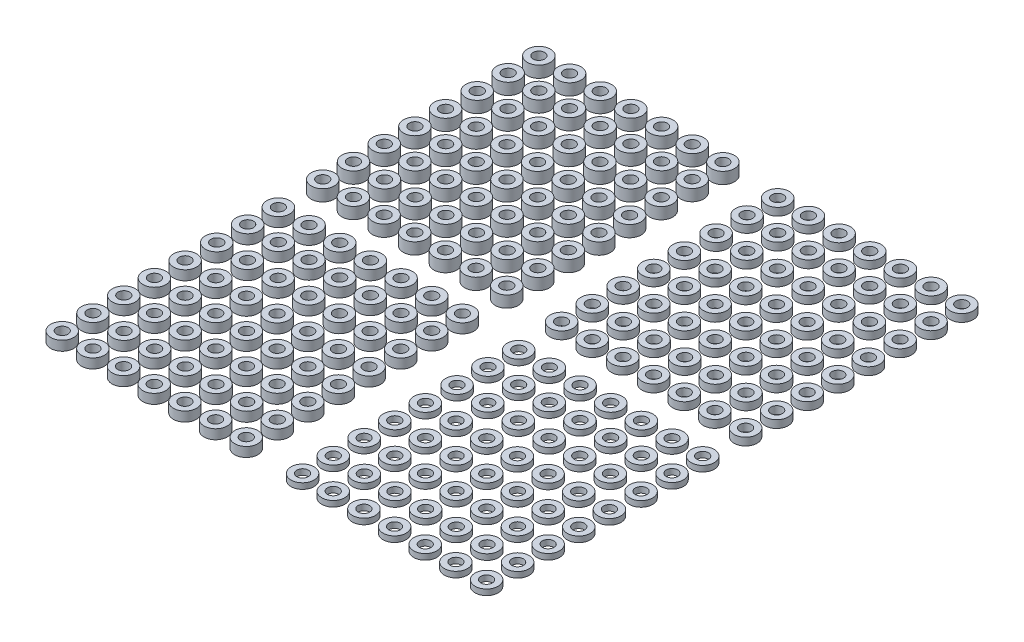
from build123d import *

# Parameters (mm, degrees)
SKETCH_1_R         = 3
SKETCH_1_R_2       = 1.5
EXTRUDE_1_DEPTH    = 3
EXTRUDE_1_2_DEPTH  = 3
EXTRUDE_1_3_DEPTH  = 3
EXTRUDE_1_4_DEPTH  = 3
EXTRUDE_1_5_DEPTH  = 3
EXTRUDE_1_6_DEPTH  = 3
EXTRUDE_1_7_DEPTH  = 3
EXTRUDE_1_8_DEPTH  = 3
EXTRUDE_1_9_DEPTH  = 3
EXTRUDE_1_10_DEPTH = 3
EXTRUDE_1_11_DEPTH = 3
EXTRUDE_1_12_DEPTH = 3
EXTRUDE_1_13_DEPTH = 3
EXTRUDE_1_14_DEPTH = 3
EXTRUDE_1_15_DEPTH = 3
EXTRUDE_1_16_DEPTH = 3
EXTRUDE_1_17_DEPTH = 3
EXTRUDE_1_18_DEPTH = 3
EXTRUDE_1_19_DEPTH = 3
EXTRUDE_1_20_DEPTH = 3
EXTRUDE_1_21_DEPTH = 3
EXTRUDE_1_22_DEPTH = 3
EXTRUDE_1_23_DEPTH = 3
EXTRUDE_1_24_DEPTH = 3
EXTRUDE_1_25_DEPTH = 3
EXTRUDE_1_26_DEPTH = 3
EXTRUDE_1_27_DEPTH = 3
EXTRUDE_1_28_DEPTH = 3
EXTRUDE_1_29_DEPTH = 3
EXTRUDE_1_30_DEPTH = 3
EXTRUDE_1_31_DEPTH = 3
EXTRUDE_1_32_DEPTH = 3
EXTRUDE_1_33_DEPTH = 3
EXTRUDE_1_34_DEPTH = 3
EXTRUDE_1_35_DEPTH = 3
EXTRUDE_1_36_DEPTH = 3
EXTRUDE_1_37_DEPTH = 3
EXTRUDE_1_38_DEPTH = 3
EXTRUDE_1_39_DEPTH = 3
EXTRUDE_1_40_DEPTH = 3
EXTRUDE_1_41_DEPTH = 3
EXTRUDE_1_42_DEPTH = 3
EXTRUDE_1_43_DEPTH = 3
EXTRUDE_1_44_DEPTH = 3
EXTRUDE_1_45_DEPTH = 3
EXTRUDE_1_46_DEPTH = 3
EXTRUDE_1_47_DEPTH = 3
EXTRUDE_1_48_DEPTH = 3
EXTRUDE_1_49_DEPTH = 3
EXTRUDE_1_50_DEPTH = 3
EXTRUDE_1_51_DEPTH = 3
EXTRUDE_1_52_DEPTH = 3
EXTRUDE_1_53_DEPTH = 3
EXTRUDE_1_54_DEPTH = 3
EXTRUDE_1_55_DEPTH = 3
EXTRUDE_1_56_DEPTH = 3
SKETCH_3_R         = 3
SKETCH_3_R_2       = 1.5
EXTRUDE_2_DEPTH    = 2
EXTRUDE_2_2_DEPTH  = 2
EXTRUDE_2_3_DEPTH  = 2
EXTRUDE_2_4_DEPTH  = 2
EXTRUDE_2_5_DEPTH  = 2
EXTRUDE_2_6_DEPTH  = 2
EXTRUDE_2_7_DEPTH  = 2
EXTRUDE_2_8_DEPTH  = 2
EXTRUDE_2_9_DEPTH  = 2
EXTRUDE_2_10_DEPTH = 2
EXTRUDE_2_11_DEPTH = 2
EXTRUDE_2_12_DEPTH = 2
EXTRUDE_2_13_DEPTH = 2
EXTRUDE_2_14_DEPTH = 2
EXTRUDE_2_15_DEPTH = 2
EXTRUDE_2_16_DEPTH = 2
EXTRUDE_2_17_DEPTH = 2
EXTRUDE_2_18_DEPTH = 2
EXTRUDE_2_19_DEPTH = 2
EXTRUDE_2_20_DEPTH = 2
EXTRUDE_2_21_DEPTH = 2
EXTRUDE_2_22_DEPTH = 2
EXTRUDE_2_23_DEPTH = 2
EXTRUDE_2_24_DEPTH = 2
EXTRUDE_2_25_DEPTH = 2
EXTRUDE_2_26_DEPTH = 2
EXTRUDE_2_27_DEPTH = 2
EXTRUDE_2_28_DEPTH = 2
EXTRUDE_2_29_DEPTH = 2
EXTRUDE_2_30_DEPTH = 2
EXTRUDE_2_31_DEPTH = 2
EXTRUDE_2_32_DEPTH = 2
EXTRUDE_2_33_DEPTH = 2
EXTRUDE_2_34_DEPTH = 2
EXTRUDE_2_35_DEPTH = 2
EXTRUDE_2_36_DEPTH = 2
EXTRUDE_2_37_DEPTH = 2
EXTRUDE_2_38_DEPTH = 2
EXTRUDE_2_39_DEPTH = 2
EXTRUDE_2_40_DEPTH = 2
EXTRUDE_2_41_DEPTH = 2
EXTRUDE_2_42_DEPTH = 2
EXTRUDE_2_43_DEPTH = 2
EXTRUDE_2_44_DEPTH = 2
EXTRUDE_2_45_DEPTH = 2
EXTRUDE_2_46_DEPTH = 2
EXTRUDE_2_47_DEPTH = 2
EXTRUDE_2_48_DEPTH = 2
EXTRUDE_2_49_DEPTH = 2
EXTRUDE_2_50_DEPTH = 2
EXTRUDE_2_51_DEPTH = 2
EXTRUDE_2_52_DEPTH = 2
EXTRUDE_2_53_DEPTH = 2
EXTRUDE_2_54_DEPTH = 2
EXTRUDE_2_55_DEPTH = 2
EXTRUDE_2_56_DEPTH = 2
SKETCH_5_R         = 3
SKETCH_5_R_2       = 1.5
EXTRUDE_3_DEPTH    = 2.5
EXTRUDE_3_2_DEPTH  = 2.5
EXTRUDE_3_3_DEPTH  = 2.5
EXTRUDE_3_4_DEPTH  = 2.5
EXTRUDE_3_5_DEPTH  = 2.5
EXTRUDE_3_6_DEPTH  = 2.5
EXTRUDE_3_7_DEPTH  = 2.5
EXTRUDE_3_8_DEPTH  = 2.5
EXTRUDE_3_9_DEPTH  = 2.5
EXTRUDE_3_10_DEPTH = 2.5
EXTRUDE_3_11_DEPTH = 2.5
EXTRUDE_3_12_DEPTH = 2.5
EXTRUDE_3_13_DEPTH = 2.5
EXTRUDE_3_14_DEPTH = 2.5
EXTRUDE_3_15_DEPTH = 2.5
EXTRUDE_3_16_DEPTH = 2.5
EXTRUDE_3_17_DEPTH = 2.5
EXTRUDE_3_18_DEPTH = 2.5
EXTRUDE_3_19_DEPTH = 2.5
EXTRUDE_3_20_DEPTH = 2.5
EXTRUDE_3_21_DEPTH = 2.5
EXTRUDE_3_22_DEPTH = 2.5
EXTRUDE_3_23_DEPTH = 2.5
EXTRUDE_3_24_DEPTH = 2.5
EXTRUDE_3_25_DEPTH = 2.5
EXTRUDE_3_26_DEPTH = 2.5
EXTRUDE_3_27_DEPTH = 2.5
EXTRUDE_3_28_DEPTH = 2.5
EXTRUDE_3_29_DEPTH = 2.5
EXTRUDE_3_30_DEPTH = 2.5
EXTRUDE_3_31_DEPTH = 2.5
EXTRUDE_3_32_DEPTH = 2.5
EXTRUDE_3_33_DEPTH = 2.5
EXTRUDE_3_34_DEPTH = 2.5
EXTRUDE_3_35_DEPTH = 2.5
EXTRUDE_3_36_DEPTH = 2.5
EXTRUDE_3_37_DEPTH = 2.5
EXTRUDE_3_38_DEPTH = 2.5
EXTRUDE_3_39_DEPTH = 2.5
EXTRUDE_3_40_DEPTH = 2.5
EXTRUDE_3_41_DEPTH = 2.5
EXTRUDE_3_42_DEPTH = 2.5
EXTRUDE_3_43_DEPTH = 2.5
EXTRUDE_3_44_DEPTH = 2.5
EXTRUDE_3_45_DEPTH = 2.5
EXTRUDE_3_46_DEPTH = 2.5
EXTRUDE_3_47_DEPTH = 2.5
EXTRUDE_3_48_DEPTH = 2.5
EXTRUDE_3_49_DEPTH = 2.5
EXTRUDE_3_50_DEPTH = 2.5
EXTRUDE_3_51_DEPTH = 2.5
EXTRUDE_3_52_DEPTH = 2.5
EXTRUDE_3_53_DEPTH = 2.5
EXTRUDE_3_54_DEPTH = 2.5
EXTRUDE_3_55_DEPTH = 2.5
EXTRUDE_3_56_DEPTH = 2.5
SKETCH_6_R         = 3
SKETCH_6_R_2       = 1.5
EXTRUDE_4_DEPTH    = 1.5
EXTRUDE_4_2_DEPTH  = 1.5
EXTRUDE_4_3_DEPTH  = 1.5
EXTRUDE_4_4_DEPTH  = 1.5
EXTRUDE_4_5_DEPTH  = 1.5
EXTRUDE_4_6_DEPTH  = 1.5
EXTRUDE_4_7_DEPTH  = 1.5
EXTRUDE_4_8_DEPTH  = 1.5
EXTRUDE_4_9_DEPTH  = 1.5
EXTRUDE_4_10_DEPTH = 1.5
EXTRUDE_4_11_DEPTH = 1.5
EXTRUDE_4_12_DEPTH = 1.5
EXTRUDE_4_13_DEPTH = 1.5
EXTRUDE_4_14_DEPTH = 1.5
EXTRUDE_4_15_DEPTH = 1.5
EXTRUDE_4_16_DEPTH = 1.5
EXTRUDE_4_17_DEPTH = 1.5
EXTRUDE_4_18_DEPTH = 1.5
EXTRUDE_4_19_DEPTH = 1.5
EXTRUDE_4_20_DEPTH = 1.5
EXTRUDE_4_21_DEPTH = 1.5
EXTRUDE_4_22_DEPTH = 1.5
EXTRUDE_4_23_DEPTH = 1.5
EXTRUDE_4_24_DEPTH = 1.5
EXTRUDE_4_25_DEPTH = 1.5
EXTRUDE_4_26_DEPTH = 1.5
EXTRUDE_4_27_DEPTH = 1.5
EXTRUDE_4_28_DEPTH = 1.5
EXTRUDE_4_29_DEPTH = 1.5
EXTRUDE_4_30_DEPTH = 1.5
EXTRUDE_4_31_DEPTH = 1.5
EXTRUDE_4_32_DEPTH = 1.5
EXTRUDE_4_33_DEPTH = 1.5
EXTRUDE_4_34_DEPTH = 1.5
EXTRUDE_4_35_DEPTH = 1.5
EXTRUDE_4_36_DEPTH = 1.5
EXTRUDE_4_37_DEPTH = 1.5
EXTRUDE_4_38_DEPTH = 1.5
EXTRUDE_4_39_DEPTH = 1.5
EXTRUDE_4_40_DEPTH = 1.5
EXTRUDE_4_41_DEPTH = 1.5
EXTRUDE_4_42_DEPTH = 1.5
EXTRUDE_4_43_DEPTH = 1.5
EXTRUDE_4_44_DEPTH = 1.5
EXTRUDE_4_45_DEPTH = 1.5
EXTRUDE_4_46_DEPTH = 1.5
EXTRUDE_4_47_DEPTH = 1.5
EXTRUDE_4_48_DEPTH = 1.5
EXTRUDE_4_49_DEPTH = 1.5
EXTRUDE_4_50_DEPTH = 1.5
EXTRUDE_4_51_DEPTH = 1.5
EXTRUDE_4_52_DEPTH = 1.5
EXTRUDE_4_53_DEPTH = 1.5
EXTRUDE_4_54_DEPTH = 1.5
EXTRUDE_4_55_DEPTH = 1.5
EXTRUDE_4_56_DEPTH = 1.5


with BuildPart() as part:
    # 草图1 → 凸台-拉伸1 (new body)
    with BuildSketch(Plane(origin=(0, 0, 0), x_dir=(1, 0, 0), z_dir=(0, 1, 0))):
        with Locations(Location((0, 0, 0), (0, 0, 270))):
            Circle(SKETCH_1_R)
        with Locations(Location((0, 0, 0), (0, 0, 270))):
            Circle(SKETCH_1_R_2, mode=Mode.SUBTRACT)
    extrude(amount=EXTRUDE_1_DEPTH)


with BuildPart() as body_2:
    # 草图1 → Extrude 1 2 (new body)
    with BuildSketch(Plane(origin=(0, 0, 0), x_dir=(1, 0, 0), z_dir=(0, 1, 0))):
        with Locations(Location((8, 0, 0), (0, 0, 270))):
            Circle(SKETCH_1_R)
        with Locations(Location((8, 0, 0), (0, 0, 270))):
            Circle(SKETCH_1_R_2, mode=Mode.SUBTRACT)
    extrude(amount=EXTRUDE_1_2_DEPTH)


with BuildPart() as body_3:
    # 草图1 → Extrude 1 3 (new body)
    with BuildSketch(Plane(origin=(0, 0, 0), x_dir=(1, 0, 0), z_dir=(0, 1, 0))):
        with Locations(Location((16, 0, 0), (0, 0, 270))):
            Circle(SKETCH_1_R)
        with Locations(Location((16, 0, 0), (0, 0, 270))):
            Circle(SKETCH_1_R_2, mode=Mode.SUBTRACT)
    extrude(amount=EXTRUDE_1_3_DEPTH)


with BuildPart() as body_4:
    # 草图1 → Extrude 1 4 (new body)
    with BuildSketch(Plane(origin=(0, 0, 0), x_dir=(1, 0, 0), z_dir=(0, 1, 0))):
        with Locations(Location((24, 0, 0), (0, 0, 270))):
            Circle(SKETCH_1_R)
        with Locations(Location((24, 0, 0), (0, 0, 270))):
            Circle(SKETCH_1_R_2, mode=Mode.SUBTRACT)
    extrude(amount=EXTRUDE_1_4_DEPTH)


with BuildPart() as body_5:
    # 草图1 → Extrude 1 5 (new body)
    with BuildSketch(Plane(origin=(0, 0, 0), x_dir=(1, 0, 0), z_dir=(0, 1, 0))):
        with Locations(Location((32, 0, 0), (0, 0, 270))):
            Circle(SKETCH_1_R)
        with Locations(Location((32, 0, 0), (0, 0, 270))):
            Circle(SKETCH_1_R_2, mode=Mode.SUBTRACT)
    extrude(amount=EXTRUDE_1_5_DEPTH)


with BuildPart() as body_6:
    # 草图1 → Extrude 1 6 (new body)
    with BuildSketch(Plane(origin=(0, 0, 0), x_dir=(1, 0, 0), z_dir=(0, 1, 0))):
        with Locations(Location((40, 0, 0), (0, 0, 270))):
            Circle(SKETCH_1_R)
        with Locations(Location((40, 0, 0), (0, 0, 270))):
            Circle(SKETCH_1_R_2, mode=Mode.SUBTRACT)
    extrude(amount=EXTRUDE_1_6_DEPTH)


with BuildPart() as body_7:
    # 草图1 → Extrude 1 7 (new body)
    with BuildSketch(Plane(origin=(0, 0, 0), x_dir=(1, 0, 0), z_dir=(0, 1, 0))):
        with Locations(Location((48, 0, 0), (0, 0, 270))):
            Circle(SKETCH_1_R)
        with Locations(Location((48, 0, 0), (0, 0, 270))):
            Circle(SKETCH_1_R_2, mode=Mode.SUBTRACT)
    extrude(amount=EXTRUDE_1_7_DEPTH)


with BuildPart() as body_8:
    # 草图1 → Extrude 1 8 (new body)
    with BuildSketch(Plane(origin=(0, 0, 0), x_dir=(1, 0, 0), z_dir=(0, 1, 0))):
        with Locations(Location((0.01003514, 8.007464765, 0), (0, 0, 270))):
            Circle(SKETCH_1_R)
        with Locations(Location((0.01003514, 8.007464765, 0), (0, 0, 270))):
            Circle(SKETCH_1_R_2, mode=Mode.SUBTRACT)
    extrude(amount=EXTRUDE_1_8_DEPTH)


with BuildPart() as body_9:
    # 草图1 → Extrude 1 9 (new body)
    with BuildSketch(Plane(origin=(0, 0, 0), x_dir=(1, 0, 0), z_dir=(0, 1, 0))):
        with Locations(Location((8.096065786, 8.007464765, 0), (0, 0, 270))):
            Circle(SKETCH_1_R)
        with Locations(Location((8.096065786, 8.007464765, 0), (0, 0, 270))):
            Circle(SKETCH_1_R_2, mode=Mode.SUBTRACT)
    extrude(amount=EXTRUDE_1_9_DEPTH)


with BuildPart() as body_10:
    # 草图1 → Extrude 1 10 (new body)
    with BuildSketch(Plane(origin=(0, 0, 0), x_dir=(1, 0, 0), z_dir=(0, 1, 0))):
        with Locations(Location((16.096065786, 8.007464765, 0), (0, 0, 270))):
            Circle(SKETCH_1_R)
        with Locations(Location((16.096065786, 8.007464765, 0), (0, 0, 270))):
            Circle(SKETCH_1_R_2, mode=Mode.SUBTRACT)
    extrude(amount=EXTRUDE_1_10_DEPTH)


with BuildPart() as body_11:
    # 草图1 → Extrude 1 11 (new body)
    with BuildSketch(Plane(origin=(0, 0, 0), x_dir=(1, 0, 0), z_dir=(0, 1, 0))):
        with Locations(Location((24.096065786, 8.007464765, 0), (0, 0, 270))):
            Circle(SKETCH_1_R)
        with Locations(Location((24.096065786, 8.007464765, 0), (0, 0, 270))):
            Circle(SKETCH_1_R_2, mode=Mode.SUBTRACT)
    extrude(amount=EXTRUDE_1_11_DEPTH)


with BuildPart() as body_12:
    # 草图1 → Extrude 1 12 (new body)
    with BuildSketch(Plane(origin=(0, 0, 0), x_dir=(1, 0, 0), z_dir=(0, 1, 0))):
        with Locations(Location((32.096065786, 8.007464765, 0), (0, 0, 270))):
            Circle(SKETCH_1_R)
        with Locations(Location((32.096065786, 8.007464765, 0), (0, 0, 270))):
            Circle(SKETCH_1_R_2, mode=Mode.SUBTRACT)
    extrude(amount=EXTRUDE_1_12_DEPTH)


with BuildPart() as body_13:
    # 草图1 → Extrude 1 13 (new body)
    with BuildSketch(Plane(origin=(0, 0, 0), x_dir=(1, 0, 0), z_dir=(0, 1, 0))):
        with Locations(Location((40.096065786, 8.007464765, 0), (0, 0, 270))):
            Circle(SKETCH_1_R)
        with Locations(Location((40.096065786, 8.007464765, 0), (0, 0, 270))):
            Circle(SKETCH_1_R_2, mode=Mode.SUBTRACT)
    extrude(amount=EXTRUDE_1_13_DEPTH)


with BuildPart() as body_14:
    # 草图1 → Extrude 1 14 (new body)
    with BuildSketch(Plane(origin=(0, 0, 0), x_dir=(1, 0, 0), z_dir=(0, 1, 0))):
        with Locations(Location((48.096065786, 8.007464765, 0), (0, 0, 270))):
            Circle(SKETCH_1_R)
        with Locations(Location((48.096065786, 8.007464765, 0), (0, 0, 270))):
            Circle(SKETCH_1_R_2, mode=Mode.SUBTRACT)
    extrude(amount=EXTRUDE_1_14_DEPTH)


with BuildPart() as body_15:
    # 草图1 → Extrude 1 15 (new body)
    with BuildSketch(Plane(origin=(0, 0, 0), x_dir=(1, 0, 0), z_dir=(0, 1, 0))):
        with Locations(Location((0.009926729, 16.047122952, 0), (0, 0, 270))):
            Circle(SKETCH_1_R)
        with Locations(Location((0.009926729, 16.047122952, 0), (0, 0, 270))):
            Circle(SKETCH_1_R_2, mode=Mode.SUBTRACT)
    extrude(amount=EXTRUDE_1_15_DEPTH)


with BuildPart() as body_16:
    # 草图1 → Extrude 1 16 (new body)
    with BuildSketch(Plane(origin=(0, 0, 0), x_dir=(1, 0, 0), z_dir=(0, 1, 0))):
        with Locations(Location((8.009926729, 16.047122952, 0), (0, 0, 270))):
            Circle(SKETCH_1_R)
        with Locations(Location((8.009926729, 16.047122952, 0), (0, 0, 270))):
            Circle(SKETCH_1_R_2, mode=Mode.SUBTRACT)
    extrude(amount=EXTRUDE_1_16_DEPTH)


with BuildPart() as body_17:
    # 草图1 → Extrude 1 17 (new body)
    with BuildSketch(Plane(origin=(0, 0, 0), x_dir=(1, 0, 0), z_dir=(0, 1, 0))):
        with Locations(Location((16.009926729, 16.047122952, 0), (0, 0, 270))):
            Circle(SKETCH_1_R)
        with Locations(Location((16.009926729, 16.047122952, 0), (0, 0, 270))):
            Circle(SKETCH_1_R_2, mode=Mode.SUBTRACT)
    extrude(amount=EXTRUDE_1_17_DEPTH)


with BuildPart() as body_18:
    # 草图1 → Extrude 1 18 (new body)
    with BuildSketch(Plane(origin=(0, 0, 0), x_dir=(1, 0, 0), z_dir=(0, 1, 0))):
        with Locations(Location((24.009926729, 16.047122952, 0), (0, 0, 270))):
            Circle(SKETCH_1_R)
        with Locations(Location((24.009926729, 16.047122952, 0), (0, 0, 270))):
            Circle(SKETCH_1_R_2, mode=Mode.SUBTRACT)
    extrude(amount=EXTRUDE_1_18_DEPTH)


with BuildPart() as body_19:
    # 草图1 → Extrude 1 19 (new body)
    with BuildSketch(Plane(origin=(0, 0, 0), x_dir=(1, 0, 0), z_dir=(0, 1, 0))):
        with Locations(Location((32.009926729, 16.047122952, 0), (0, 0, 270))):
            Circle(SKETCH_1_R)
        with Locations(Location((32.009926729, 16.047122952, 0), (0, 0, 270))):
            Circle(SKETCH_1_R_2, mode=Mode.SUBTRACT)
    extrude(amount=EXTRUDE_1_19_DEPTH)


with BuildPart() as body_20:
    # 草图1 → Extrude 1 20 (new body)
    with BuildSketch(Plane(origin=(0, 0, 0), x_dir=(1, 0, 0), z_dir=(0, 1, 0))):
        with Locations(Location((40.009926729, 16.047122952, 0), (0, 0, 270))):
            Circle(SKETCH_1_R)
        with Locations(Location((40.009926729, 16.047122952, 0), (0, 0, 270))):
            Circle(SKETCH_1_R_2, mode=Mode.SUBTRACT)
    extrude(amount=EXTRUDE_1_20_DEPTH)


with BuildPart() as body_21:
    # 草图1 → Extrude 1 21 (new body)
    with BuildSketch(Plane(origin=(0, 0, 0), x_dir=(1, 0, 0), z_dir=(0, 1, 0))):
        with Locations(Location((48.009926729, 16.047122952, 0), (0, 0, 270))):
            Circle(SKETCH_1_R)
        with Locations(Location((48.009926729, 16.047122952, 0), (0, 0, 270))):
            Circle(SKETCH_1_R_2, mode=Mode.SUBTRACT)
    extrude(amount=EXTRUDE_1_21_DEPTH)


with BuildPart() as body_22:
    # 草图1 → Extrude 1 22 (new body)
    with BuildSketch(Plane(origin=(0, 0, 0), x_dir=(1, 0, 0), z_dir=(0, 1, 0))):
        with Locations(Location((0.059776337, 23.99189556, 0), (0, 0, 270))):
            Circle(SKETCH_1_R)
        with Locations(Location((0.059776337, 23.99189556, 0), (0, 0, 270))):
            Circle(SKETCH_1_R_2, mode=Mode.SUBTRACT)
    extrude(amount=EXTRUDE_1_22_DEPTH)


with BuildPart() as body_23:
    # 草图1 → Extrude 1 23 (new body)
    with BuildSketch(Plane(origin=(0, 0, 0), x_dir=(1, 0, 0), z_dir=(0, 1, 0))):
        with Locations(Location((8.059776337, 23.99189556, 0), (0, 0, 270))):
            Circle(SKETCH_1_R)
        with Locations(Location((8.059776337, 23.99189556, 0), (0, 0, 270))):
            Circle(SKETCH_1_R_2, mode=Mode.SUBTRACT)
    extrude(amount=EXTRUDE_1_23_DEPTH)


with BuildPart() as body_24:
    # 草图1 → Extrude 1 24 (new body)
    with BuildSketch(Plane(origin=(0, 0, 0), x_dir=(1, 0, 0), z_dir=(0, 1, 0))):
        with Locations(Location((16.059776337, 23.99189556, 0), (0, 0, 270))):
            Circle(SKETCH_1_R)
        with Locations(Location((16.059776337, 23.99189556, 0), (0, 0, 270))):
            Circle(SKETCH_1_R_2, mode=Mode.SUBTRACT)
    extrude(amount=EXTRUDE_1_24_DEPTH)


with BuildPart() as body_25:
    # 草图1 → Extrude 1 25 (new body)
    with BuildSketch(Plane(origin=(0, 0, 0), x_dir=(1, 0, 0), z_dir=(0, 1, 0))):
        with Locations(Location((24.059776337, 23.99189556, 0), (0, 0, 270))):
            Circle(SKETCH_1_R)
        with Locations(Location((24.059776337, 23.99189556, 0), (0, 0, 270))):
            Circle(SKETCH_1_R_2, mode=Mode.SUBTRACT)
    extrude(amount=EXTRUDE_1_25_DEPTH)


with BuildPart() as body_26:
    # 草图1 → Extrude 1 26 (new body)
    with BuildSketch(Plane(origin=(0, 0, 0), x_dir=(1, 0, 0), z_dir=(0, 1, 0))):
        with Locations(Location((32.059776337, 23.99189556, 0), (0, 0, 270))):
            Circle(SKETCH_1_R)
        with Locations(Location((32.059776337, 23.99189556, 0), (0, 0, 270))):
            Circle(SKETCH_1_R_2, mode=Mode.SUBTRACT)
    extrude(amount=EXTRUDE_1_26_DEPTH)


with BuildPart() as body_27:
    # 草图1 → Extrude 1 27 (new body)
    with BuildSketch(Plane(origin=(0, 0, 0), x_dir=(1, 0, 0), z_dir=(0, 1, 0))):
        with Locations(Location((40.059776337, 23.99189556, 0), (0, 0, 270))):
            Circle(SKETCH_1_R)
        with Locations(Location((40.059776337, 23.99189556, 0), (0, 0, 270))):
            Circle(SKETCH_1_R_2, mode=Mode.SUBTRACT)
    extrude(amount=EXTRUDE_1_27_DEPTH)


with BuildPart() as body_28:
    # 草图1 → Extrude 1 28 (new body)
    with BuildSketch(Plane(origin=(0, 0, 0), x_dir=(1, 0, 0), z_dir=(0, 1, 0))):
        with Locations(Location((48.059776337, 23.99189556, 0), (0, 0, 270))):
            Circle(SKETCH_1_R)
        with Locations(Location((48.059776337, 23.99189556, 0), (0, 0, 270))):
            Circle(SKETCH_1_R_2, mode=Mode.SUBTRACT)
    extrude(amount=EXTRUDE_1_28_DEPTH)


with BuildPart() as body_29:
    # 草图1 → Extrude 1 29 (new body)
    with BuildSketch(Plane(origin=(0, 0, 0), x_dir=(1, 0, 0), z_dir=(0, 1, 0))):
        with Locations(Location((0.111855376, 31.929761142, 0), (0, 0, 270))):
            Circle(SKETCH_1_R)
        with Locations(Location((0.111855376, 31.929761142, 0), (0, 0, 270))):
            Circle(SKETCH_1_R_2, mode=Mode.SUBTRACT)
    extrude(amount=EXTRUDE_1_29_DEPTH)


with BuildPart() as body_30:
    # 草图1 → Extrude 1 30 (new body)
    with BuildSketch(Plane(origin=(0, 0, 0), x_dir=(1, 0, 0), z_dir=(0, 1, 0))):
        with Locations(Location((8.111855376, 31.929761142, 0), (0, 0, 270))):
            Circle(SKETCH_1_R)
        with Locations(Location((8.111855376, 31.929761142, 0), (0, 0, 270))):
            Circle(SKETCH_1_R_2, mode=Mode.SUBTRACT)
    extrude(amount=EXTRUDE_1_30_DEPTH)


with BuildPart() as body_31:
    # 草图1 → Extrude 1 31 (new body)
    with BuildSketch(Plane(origin=(0, 0, 0), x_dir=(1, 0, 0), z_dir=(0, 1, 0))):
        with Locations(Location((16.111855376, 31.929761142, 0), (0, 0, 270))):
            Circle(SKETCH_1_R)
        with Locations(Location((16.111855376, 31.929761142, 0), (0, 0, 270))):
            Circle(SKETCH_1_R_2, mode=Mode.SUBTRACT)
    extrude(amount=EXTRUDE_1_31_DEPTH)


with BuildPart() as body_32:
    # 草图1 → Extrude 1 32 (new body)
    with BuildSketch(Plane(origin=(0, 0, 0), x_dir=(1, 0, 0), z_dir=(0, 1, 0))):
        with Locations(Location((24.111855376, 31.929761142, 0), (0, 0, 270))):
            Circle(SKETCH_1_R)
        with Locations(Location((24.111855376, 31.929761142, 0), (0, 0, 270))):
            Circle(SKETCH_1_R_2, mode=Mode.SUBTRACT)
    extrude(amount=EXTRUDE_1_32_DEPTH)


with BuildPart() as body_33:
    # 草图1 → Extrude 1 33 (new body)
    with BuildSketch(Plane(origin=(0, 0, 0), x_dir=(1, 0, 0), z_dir=(0, 1, 0))):
        with Locations(Location((32.111855376, 31.929761142, 0), (0, 0, 270))):
            Circle(SKETCH_1_R)
        with Locations(Location((32.111855376, 31.929761142, 0), (0, 0, 270))):
            Circle(SKETCH_1_R_2, mode=Mode.SUBTRACT)
    extrude(amount=EXTRUDE_1_33_DEPTH)


with BuildPart() as body_34:
    # 草图1 → Extrude 1 34 (new body)
    with BuildSketch(Plane(origin=(0, 0, 0), x_dir=(1, 0, 0), z_dir=(0, 1, 0))):
        with Locations(Location((40.111855376, 31.929761142, 0), (0, 0, 270))):
            Circle(SKETCH_1_R)
        with Locations(Location((40.111855376, 31.929761142, 0), (0, 0, 270))):
            Circle(SKETCH_1_R_2, mode=Mode.SUBTRACT)
    extrude(amount=EXTRUDE_1_34_DEPTH)


with BuildPart() as body_35:
    # 草图1 → Extrude 1 35 (new body)
    with BuildSketch(Plane(origin=(0, 0, 0), x_dir=(1, 0, 0), z_dir=(0, 1, 0))):
        with Locations(Location((48.111855376, 31.929761142, 0), (0, 0, 270))):
            Circle(SKETCH_1_R)
        with Locations(Location((48.111855376, 31.929761142, 0), (0, 0, 270))):
            Circle(SKETCH_1_R_2, mode=Mode.SUBTRACT)
    extrude(amount=EXTRUDE_1_35_DEPTH)


with BuildPart() as body_36:
    # 草图1 → Extrude 1 36 (new body)
    with BuildSketch(Plane(origin=(0, 0, 0), x_dir=(1, 0, 0), z_dir=(0, 1, 0))):
        with Locations(Location((0.186351973, 40.112557269, 0), (0, 0, 270))):
            Circle(SKETCH_1_R)
        with Locations(Location((0.186351973, 40.112557269, 0), (0, 0, 270))):
            Circle(SKETCH_1_R_2, mode=Mode.SUBTRACT)
    extrude(amount=EXTRUDE_1_36_DEPTH)


with BuildPart() as body_37:
    # 草图1 → Extrude 1 37 (new body)
    with BuildSketch(Plane(origin=(0, 0, 0), x_dir=(1, 0, 0), z_dir=(0, 1, 0))):
        with Locations(Location((8.186351973, 40.112557269, 0), (0, 0, 270))):
            Circle(SKETCH_1_R)
        with Locations(Location((8.186351973, 40.112557269, 0), (0, 0, 270))):
            Circle(SKETCH_1_R_2, mode=Mode.SUBTRACT)
    extrude(amount=EXTRUDE_1_37_DEPTH)


with BuildPart() as body_38:
    # 草图1 → Extrude 1 38 (new body)
    with BuildSketch(Plane(origin=(0, 0, 0), x_dir=(1, 0, 0), z_dir=(0, 1, 0))):
        with Locations(Location((16.186351973, 40.112557269, 0), (0, 0, 270))):
            Circle(SKETCH_1_R)
        with Locations(Location((16.186351973, 40.112557269, 0), (0, 0, 270))):
            Circle(SKETCH_1_R_2, mode=Mode.SUBTRACT)
    extrude(amount=EXTRUDE_1_38_DEPTH)


with BuildPart() as body_39:
    # 草图1 → Extrude 1 39 (new body)
    with BuildSketch(Plane(origin=(0, 0, 0), x_dir=(1, 0, 0), z_dir=(0, 1, 0))):
        with Locations(Location((24.186351973, 40.112557269, 0), (0, 0, 270))):
            Circle(SKETCH_1_R)
        with Locations(Location((24.186351973, 40.112557269, 0), (0, 0, 270))):
            Circle(SKETCH_1_R_2, mode=Mode.SUBTRACT)
    extrude(amount=EXTRUDE_1_39_DEPTH)


with BuildPart() as body_40:
    # 草图1 → Extrude 1 40 (new body)
    with BuildSketch(Plane(origin=(0, 0, 0), x_dir=(1, 0, 0), z_dir=(0, 1, 0))):
        with Locations(Location((32.186351973, 40.112557269, 0), (0, 0, 270))):
            Circle(SKETCH_1_R)
        with Locations(Location((32.186351973, 40.112557269, 0), (0, 0, 270))):
            Circle(SKETCH_1_R_2, mode=Mode.SUBTRACT)
    extrude(amount=EXTRUDE_1_40_DEPTH)


with BuildPart() as body_41:
    # 草图1 → Extrude 1 41 (new body)
    with BuildSketch(Plane(origin=(0, 0, 0), x_dir=(1, 0, 0), z_dir=(0, 1, 0))):
        with Locations(Location((40.186351973, 40.112557269, 0), (0, 0, 270))):
            Circle(SKETCH_1_R)
        with Locations(Location((40.186351973, 40.112557269, 0), (0, 0, 270))):
            Circle(SKETCH_1_R_2, mode=Mode.SUBTRACT)
    extrude(amount=EXTRUDE_1_41_DEPTH)


with BuildPart() as body_42:
    # 草图1 → Extrude 1 42 (new body)
    with BuildSketch(Plane(origin=(0, 0, 0), x_dir=(1, 0, 0), z_dir=(0, 1, 0))):
        with Locations(Location((48.186351973, 40.112557269, 0), (0, 0, 270))):
            Circle(SKETCH_1_R)
        with Locations(Location((48.186351973, 40.112557269, 0), (0, 0, 270))):
            Circle(SKETCH_1_R_2, mode=Mode.SUBTRACT)
    extrude(amount=EXTRUDE_1_42_DEPTH)


with BuildPart() as body_43:
    # 草图1 → Extrude 1 43 (new body)
    with BuildSketch(Plane(origin=(0, 0, 0), x_dir=(1, 0, 0), z_dir=(0, 1, 0))):
        with Locations(Location((0.136260613, 48.228080891, 0), (0, 0, 270))):
            Circle(SKETCH_1_R)
        with Locations(Location((0.136260613, 48.228080891, 0), (0, 0, 270))):
            Circle(SKETCH_1_R_2, mode=Mode.SUBTRACT)
    extrude(amount=EXTRUDE_1_43_DEPTH)


with BuildPart() as body_44:
    # 草图1 → Extrude 1 44 (new body)
    with BuildSketch(Plane(origin=(0, 0, 0), x_dir=(1, 0, 0), z_dir=(0, 1, 0))):
        with Locations(Location((8.136260613, 48.228080891, 0), (0, 0, 270))):
            Circle(SKETCH_1_R)
        with Locations(Location((8.136260613, 48.228080891, 0), (0, 0, 270))):
            Circle(SKETCH_1_R_2, mode=Mode.SUBTRACT)
    extrude(amount=EXTRUDE_1_44_DEPTH)


with BuildPart() as body_45:
    # 草图1 → Extrude 1 45 (new body)
    with BuildSketch(Plane(origin=(0, 0, 0), x_dir=(1, 0, 0), z_dir=(0, 1, 0))):
        with Locations(Location((16.136260613, 48.228080891, 0), (0, 0, 270))):
            Circle(SKETCH_1_R)
        with Locations(Location((16.136260613, 48.228080891, 0), (0, 0, 270))):
            Circle(SKETCH_1_R_2, mode=Mode.SUBTRACT)
    extrude(amount=EXTRUDE_1_45_DEPTH)


with BuildPart() as body_46:
    # 草图1 → Extrude 1 46 (new body)
    with BuildSketch(Plane(origin=(0, 0, 0), x_dir=(1, 0, 0), z_dir=(0, 1, 0))):
        with Locations(Location((24.136260613, 48.228080891, 0), (0, 0, 270))):
            Circle(SKETCH_1_R)
        with Locations(Location((24.136260613, 48.228080891, 0), (0, 0, 270))):
            Circle(SKETCH_1_R_2, mode=Mode.SUBTRACT)
    extrude(amount=EXTRUDE_1_46_DEPTH)


with BuildPart() as body_47:
    # 草图1 → Extrude 1 47 (new body)
    with BuildSketch(Plane(origin=(0, 0, 0), x_dir=(1, 0, 0), z_dir=(0, 1, 0))):
        with Locations(Location((32.136260613, 48.228080891, 0), (0, 0, 270))):
            Circle(SKETCH_1_R)
        with Locations(Location((32.136260613, 48.228080891, 0), (0, 0, 270))):
            Circle(SKETCH_1_R_2, mode=Mode.SUBTRACT)
    extrude(amount=EXTRUDE_1_47_DEPTH)


with BuildPart() as body_48:
    # 草图1 → Extrude 1 48 (new body)
    with BuildSketch(Plane(origin=(0, 0, 0), x_dir=(1, 0, 0), z_dir=(0, 1, 0))):
        with Locations(Location((40.136260613, 48.228080891, 0), (0, 0, 270))):
            Circle(SKETCH_1_R)
        with Locations(Location((40.136260613, 48.228080891, 0), (0, 0, 270))):
            Circle(SKETCH_1_R_2, mode=Mode.SUBTRACT)
    extrude(amount=EXTRUDE_1_48_DEPTH)


with BuildPart() as body_49:
    # 草图1 → Extrude 1 49 (new body)
    with BuildSketch(Plane(origin=(0, 0, 0), x_dir=(1, 0, 0), z_dir=(0, 1, 0))):
        with Locations(Location((48.136260613, 48.228080891, 0), (0, 0, 270))):
            Circle(SKETCH_1_R)
        with Locations(Location((48.136260613, 48.228080891, 0), (0, 0, 270))):
            Circle(SKETCH_1_R_2, mode=Mode.SUBTRACT)
    extrude(amount=EXTRUDE_1_49_DEPTH)


with BuildPart() as body_50:
    # 草图1 → Extrude 1 50 (new body)
    with BuildSketch(Plane(origin=(0, 0, 0), x_dir=(1, 0, 0), z_dir=(0, 1, 0))):
        with Locations(Location((0.265067682, 56.112085352, 0), (0, 0, 270))):
            Circle(SKETCH_1_R)
        with Locations(Location((0.265067682, 56.112085352, 0), (0, 0, 270))):
            Circle(SKETCH_1_R_2, mode=Mode.SUBTRACT)
    extrude(amount=EXTRUDE_1_50_DEPTH)


with BuildPart() as body_51:
    # 草图1 → Extrude 1 51 (new body)
    with BuildSketch(Plane(origin=(0, 0, 0), x_dir=(1, 0, 0), z_dir=(0, 1, 0))):
        with Locations(Location((8.265067682, 56.112085352, 0), (0, 0, 270))):
            Circle(SKETCH_1_R)
        with Locations(Location((8.265067682, 56.112085352, 0), (0, 0, 270))):
            Circle(SKETCH_1_R_2, mode=Mode.SUBTRACT)
    extrude(amount=EXTRUDE_1_51_DEPTH)


with BuildPart() as body_52:
    # 草图1 → Extrude 1 52 (new body)
    with BuildSketch(Plane(origin=(0, 0, 0), x_dir=(1, 0, 0), z_dir=(0, 1, 0))):
        with Locations(Location((16.265067682, 56.112085352, 0), (0, 0, 270))):
            Circle(SKETCH_1_R)
        with Locations(Location((16.265067682, 56.112085352, 0), (0, 0, 270))):
            Circle(SKETCH_1_R_2, mode=Mode.SUBTRACT)
    extrude(amount=EXTRUDE_1_52_DEPTH)


with BuildPart() as body_53:
    # 草图1 → Extrude 1 53 (new body)
    with BuildSketch(Plane(origin=(0, 0, 0), x_dir=(1, 0, 0), z_dir=(0, 1, 0))):
        with Locations(Location((24.265067682, 56.112085352, 0), (0, 0, 270))):
            Circle(SKETCH_1_R)
        with Locations(Location((24.265067682, 56.112085352, 0), (0, 0, 270))):
            Circle(SKETCH_1_R_2, mode=Mode.SUBTRACT)
    extrude(amount=EXTRUDE_1_53_DEPTH)


with BuildPart() as body_54:
    # 草图1 → Extrude 1 54 (new body)
    with BuildSketch(Plane(origin=(0, 0, 0), x_dir=(1, 0, 0), z_dir=(0, 1, 0))):
        with Locations(Location((32.265067682, 56.112085352, 0), (0, 0, 270))):
            Circle(SKETCH_1_R)
        with Locations(Location((32.265067682, 56.112085352, 0), (0, 0, 270))):
            Circle(SKETCH_1_R_2, mode=Mode.SUBTRACT)
    extrude(amount=EXTRUDE_1_54_DEPTH)


with BuildPart() as body_55:
    # 草图1 → Extrude 1 55 (new body)
    with BuildSketch(Plane(origin=(0, 0, 0), x_dir=(1, 0, 0), z_dir=(0, 1, 0))):
        with Locations(Location((40.265067682, 56.112085352, 0), (0, 0, 270))):
            Circle(SKETCH_1_R)
        with Locations(Location((40.265067682, 56.112085352, 0), (0, 0, 270))):
            Circle(SKETCH_1_R_2, mode=Mode.SUBTRACT)
    extrude(amount=EXTRUDE_1_55_DEPTH)


with BuildPart() as body_56:
    # 草图1 → Extrude 1 56 (new body)
    with BuildSketch(Plane(origin=(0, 0, 0), x_dir=(1, 0, 0), z_dir=(0, 1, 0))):
        with Locations(Location((48.265067682, 56.112085352, 0), (0, 0, 270))):
            Circle(SKETCH_1_R)
        with Locations(Location((48.265067682, 56.112085352, 0), (0, 0, 270))):
            Circle(SKETCH_1_R_2, mode=Mode.SUBTRACT)
    extrude(amount=EXTRUDE_1_56_DEPTH)


with BuildPart() as body_57:
    # 草图3 → 凸台-拉伸2 (new body)
    with BuildSketch(Plane(origin=(0, 0, 0), x_dir=(1, 0, 0), z_dir=(0, 1, 0))):
        with Locations(Location((62.279116592, 0.017337627, 0), (0, 0, 270))):
            Circle(SKETCH_3_R)
        with Locations(Location((62.279116592, 0.017337627, 0), (0, 0, 270))):
            Circle(SKETCH_3_R_2, mode=Mode.SUBTRACT)
    extrude(amount=EXTRUDE_2_DEPTH)


with BuildPart() as body_58:
    # 草图3 → Extrude 2 2 (new body)
    with BuildSketch(Plane(origin=(0, 0, 0), x_dir=(1, 0, 0), z_dir=(0, 1, 0))):
        with Locations(Location((70.279116592, 0.017337627, 0), (0, 0, 270))):
            Circle(SKETCH_3_R)
        with Locations(Location((70.279116592, 0.017337627, 0), (0, 0, 270))):
            Circle(SKETCH_3_R_2, mode=Mode.SUBTRACT)
    extrude(amount=EXTRUDE_2_2_DEPTH)


with BuildPart() as body_59:
    # 草图3 → Extrude 2 3 (new body)
    with BuildSketch(Plane(origin=(0, 0, 0), x_dir=(1, 0, 0), z_dir=(0, 1, 0))):
        with Locations(Location((78.279116592, 0.017337627, 0), (0, 0, 270))):
            Circle(SKETCH_3_R)
        with Locations(Location((78.279116592, 0.017337627, 0), (0, 0, 270))):
            Circle(SKETCH_3_R_2, mode=Mode.SUBTRACT)
    extrude(amount=EXTRUDE_2_3_DEPTH)


with BuildPart() as body_60:
    # 草图3 → Extrude 2 4 (new body)
    with BuildSketch(Plane(origin=(0, 0, 0), x_dir=(1, 0, 0), z_dir=(0, 1, 0))):
        with Locations(Location((86.279116592, 0.017337627, 0), (0, 0, 270))):
            Circle(SKETCH_3_R)
        with Locations(Location((86.279116592, 0.017337627, 0), (0, 0, 270))):
            Circle(SKETCH_3_R_2, mode=Mode.SUBTRACT)
    extrude(amount=EXTRUDE_2_4_DEPTH)


with BuildPart() as body_61:
    # 草图3 → Extrude 2 5 (new body)
    with BuildSketch(Plane(origin=(0, 0, 0), x_dir=(1, 0, 0), z_dir=(0, 1, 0))):
        with Locations(Location((94.279116592, 0.017337627, 0), (0, 0, 270))):
            Circle(SKETCH_3_R)
        with Locations(Location((94.279116592, 0.017337627, 0), (0, 0, 270))):
            Circle(SKETCH_3_R_2, mode=Mode.SUBTRACT)
    extrude(amount=EXTRUDE_2_5_DEPTH)


with BuildPart() as body_62:
    # 草图3 → Extrude 2 6 (new body)
    with BuildSketch(Plane(origin=(0, 0, 0), x_dir=(1, 0, 0), z_dir=(0, 1, 0))):
        with Locations(Location((102.279116592, 0.017337627, 0), (0, 0, 270))):
            Circle(SKETCH_3_R)
        with Locations(Location((102.279116592, 0.017337627, 0), (0, 0, 270))):
            Circle(SKETCH_3_R_2, mode=Mode.SUBTRACT)
    extrude(amount=EXTRUDE_2_6_DEPTH)


with BuildPart() as body_63:
    # 草图3 → Extrude 2 7 (new body)
    with BuildSketch(Plane(origin=(0, 0, 0), x_dir=(1, 0, 0), z_dir=(0, 1, 0))):
        with Locations(Location((110.279116592, 0.017337627, 0), (0, 0, 270))):
            Circle(SKETCH_3_R)
        with Locations(Location((110.279116592, 0.017337627, 0), (0, 0, 270))):
            Circle(SKETCH_3_R_2, mode=Mode.SUBTRACT)
    extrude(amount=EXTRUDE_2_7_DEPTH)


with BuildPart() as body_64:
    # 草图3 → Extrude 2 8 (new body)
    with BuildSketch(Plane(origin=(0, 0, 0), x_dir=(1, 0, 0), z_dir=(0, 1, 0))):
        with Locations(Location((62.289151732, 8.024802392, 0), (0, 0, 270))):
            Circle(SKETCH_3_R)
        with Locations(Location((62.289151732, 8.024802392, 0), (0, 0, 270))):
            Circle(SKETCH_3_R_2, mode=Mode.SUBTRACT)
    extrude(amount=EXTRUDE_2_8_DEPTH)


with BuildPart() as body_65:
    # 草图3 → Extrude 2 9 (new body)
    with BuildSketch(Plane(origin=(0, 0, 0), x_dir=(1, 0, 0), z_dir=(0, 1, 0))):
        with Locations(Location((70.375182379, 8.024802392, 0), (0, 0, 270))):
            Circle(SKETCH_3_R)
        with Locations(Location((70.375182379, 8.024802392, 0), (0, 0, 270))):
            Circle(SKETCH_3_R_2, mode=Mode.SUBTRACT)
    extrude(amount=EXTRUDE_2_9_DEPTH)


with BuildPart() as body_66:
    # 草图3 → Extrude 2 10 (new body)
    with BuildSketch(Plane(origin=(0, 0, 0), x_dir=(1, 0, 0), z_dir=(0, 1, 0))):
        with Locations(Location((78.375182379, 8.024802392, 0), (0, 0, 270))):
            Circle(SKETCH_3_R)
        with Locations(Location((78.375182379, 8.024802392, 0), (0, 0, 270))):
            Circle(SKETCH_3_R_2, mode=Mode.SUBTRACT)
    extrude(amount=EXTRUDE_2_10_DEPTH)


with BuildPart() as body_67:
    # 草图3 → Extrude 2 11 (new body)
    with BuildSketch(Plane(origin=(0, 0, 0), x_dir=(1, 0, 0), z_dir=(0, 1, 0))):
        with Locations(Location((86.375182379, 8.024802392, 0), (0, 0, 270))):
            Circle(SKETCH_3_R)
        with Locations(Location((86.375182379, 8.024802392, 0), (0, 0, 270))):
            Circle(SKETCH_3_R_2, mode=Mode.SUBTRACT)
    extrude(amount=EXTRUDE_2_11_DEPTH)


with BuildPart() as body_68:
    # 草图3 → Extrude 2 12 (new body)
    with BuildSketch(Plane(origin=(0, 0, 0), x_dir=(1, 0, 0), z_dir=(0, 1, 0))):
        with Locations(Location((94.375182379, 8.024802392, 0), (0, 0, 270))):
            Circle(SKETCH_3_R)
        with Locations(Location((94.375182379, 8.024802392, 0), (0, 0, 270))):
            Circle(SKETCH_3_R_2, mode=Mode.SUBTRACT)
    extrude(amount=EXTRUDE_2_12_DEPTH)


with BuildPart() as body_69:
    # 草图3 → Extrude 2 13 (new body)
    with BuildSketch(Plane(origin=(0, 0, 0), x_dir=(1, 0, 0), z_dir=(0, 1, 0))):
        with Locations(Location((102.375182379, 8.024802392, 0), (0, 0, 270))):
            Circle(SKETCH_3_R)
        with Locations(Location((102.375182379, 8.024802392, 0), (0, 0, 270))):
            Circle(SKETCH_3_R_2, mode=Mode.SUBTRACT)
    extrude(amount=EXTRUDE_2_13_DEPTH)


with BuildPart() as body_70:
    # 草图3 → Extrude 2 14 (new body)
    with BuildSketch(Plane(origin=(0, 0, 0), x_dir=(1, 0, 0), z_dir=(0, 1, 0))):
        with Locations(Location((110.375182379, 8.024802392, 0), (0, 0, 270))):
            Circle(SKETCH_3_R)
        with Locations(Location((110.375182379, 8.024802392, 0), (0, 0, 270))):
            Circle(SKETCH_3_R_2, mode=Mode.SUBTRACT)
    extrude(amount=EXTRUDE_2_14_DEPTH)


with BuildPart() as body_71:
    # 草图3 → Extrude 2 15 (new body)
    with BuildSketch(Plane(origin=(0, 0, 0), x_dir=(1, 0, 0), z_dir=(0, 1, 0))):
        with Locations(Location((62.289043321, 16.064460579, 0), (0, 0, 270))):
            Circle(SKETCH_3_R)
        with Locations(Location((62.289043321, 16.064460579, 0), (0, 0, 270))):
            Circle(SKETCH_3_R_2, mode=Mode.SUBTRACT)
    extrude(amount=EXTRUDE_2_15_DEPTH)


with BuildPart() as body_72:
    # 草图3 → Extrude 2 16 (new body)
    with BuildSketch(Plane(origin=(0, 0, 0), x_dir=(1, 0, 0), z_dir=(0, 1, 0))):
        with Locations(Location((70.289043321, 16.064460579, 0), (0, 0, 270))):
            Circle(SKETCH_3_R)
        with Locations(Location((70.289043321, 16.064460579, 0), (0, 0, 270))):
            Circle(SKETCH_3_R_2, mode=Mode.SUBTRACT)
    extrude(amount=EXTRUDE_2_16_DEPTH)


with BuildPart() as body_73:
    # 草图3 → Extrude 2 17 (new body)
    with BuildSketch(Plane(origin=(0, 0, 0), x_dir=(1, 0, 0), z_dir=(0, 1, 0))):
        with Locations(Location((78.289043321, 16.064460579, 0), (0, 0, 270))):
            Circle(SKETCH_3_R)
        with Locations(Location((78.289043321, 16.064460579, 0), (0, 0, 270))):
            Circle(SKETCH_3_R_2, mode=Mode.SUBTRACT)
    extrude(amount=EXTRUDE_2_17_DEPTH)


with BuildPart() as body_74:
    # 草图3 → Extrude 2 18 (new body)
    with BuildSketch(Plane(origin=(0, 0, 0), x_dir=(1, 0, 0), z_dir=(0, 1, 0))):
        with Locations(Location((86.289043321, 16.064460579, 0), (0, 0, 270))):
            Circle(SKETCH_3_R)
        with Locations(Location((86.289043321, 16.064460579, 0), (0, 0, 270))):
            Circle(SKETCH_3_R_2, mode=Mode.SUBTRACT)
    extrude(amount=EXTRUDE_2_18_DEPTH)


with BuildPart() as body_75:
    # 草图3 → Extrude 2 19 (new body)
    with BuildSketch(Plane(origin=(0, 0, 0), x_dir=(1, 0, 0), z_dir=(0, 1, 0))):
        with Locations(Location((94.289043321, 16.064460579, 0), (0, 0, 270))):
            Circle(SKETCH_3_R)
        with Locations(Location((94.289043321, 16.064460579, 0), (0, 0, 270))):
            Circle(SKETCH_3_R_2, mode=Mode.SUBTRACT)
    extrude(amount=EXTRUDE_2_19_DEPTH)


with BuildPart() as body_76:
    # 草图3 → Extrude 2 20 (new body)
    with BuildSketch(Plane(origin=(0, 0, 0), x_dir=(1, 0, 0), z_dir=(0, 1, 0))):
        with Locations(Location((102.289043321, 16.064460579, 0), (0, 0, 270))):
            Circle(SKETCH_3_R)
        with Locations(Location((102.289043321, 16.064460579, 0), (0, 0, 270))):
            Circle(SKETCH_3_R_2, mode=Mode.SUBTRACT)
    extrude(amount=EXTRUDE_2_20_DEPTH)


with BuildPart() as body_77:
    # 草图3 → Extrude 2 21 (new body)
    with BuildSketch(Plane(origin=(0, 0, 0), x_dir=(1, 0, 0), z_dir=(0, 1, 0))):
        with Locations(Location((110.289043321, 16.064460579, 0), (0, 0, 270))):
            Circle(SKETCH_3_R)
        with Locations(Location((110.289043321, 16.064460579, 0), (0, 0, 270))):
            Circle(SKETCH_3_R_2, mode=Mode.SUBTRACT)
    extrude(amount=EXTRUDE_2_21_DEPTH)


with BuildPart() as body_78:
    # 草图3 → Extrude 2 22 (new body)
    with BuildSketch(Plane(origin=(0, 0, 0), x_dir=(1, 0, 0), z_dir=(0, 1, 0))):
        with Locations(Location((62.338892929, 24.009233187, 0), (0, 0, 270))):
            Circle(SKETCH_3_R)
        with Locations(Location((62.338892929, 24.009233187, 0), (0, 0, 270))):
            Circle(SKETCH_3_R_2, mode=Mode.SUBTRACT)
    extrude(amount=EXTRUDE_2_22_DEPTH)


with BuildPart() as body_79:
    # 草图3 → Extrude 2 23 (new body)
    with BuildSketch(Plane(origin=(0, 0, 0), x_dir=(1, 0, 0), z_dir=(0, 1, 0))):
        with Locations(Location((70.338892929, 24.009233187, 0), (0, 0, 270))):
            Circle(SKETCH_3_R)
        with Locations(Location((70.338892929, 24.009233187, 0), (0, 0, 270))):
            Circle(SKETCH_3_R_2, mode=Mode.SUBTRACT)
    extrude(amount=EXTRUDE_2_23_DEPTH)


with BuildPart() as body_80:
    # 草图3 → Extrude 2 24 (new body)
    with BuildSketch(Plane(origin=(0, 0, 0), x_dir=(1, 0, 0), z_dir=(0, 1, 0))):
        with Locations(Location((78.338892929, 24.009233187, 0), (0, 0, 270))):
            Circle(SKETCH_3_R)
        with Locations(Location((78.338892929, 24.009233187, 0), (0, 0, 270))):
            Circle(SKETCH_3_R_2, mode=Mode.SUBTRACT)
    extrude(amount=EXTRUDE_2_24_DEPTH)


with BuildPart() as body_81:
    # 草图3 → Extrude 2 25 (new body)
    with BuildSketch(Plane(origin=(0, 0, 0), x_dir=(1, 0, 0), z_dir=(0, 1, 0))):
        with Locations(Location((86.338892929, 24.009233187, 0), (0, 0, 270))):
            Circle(SKETCH_3_R)
        with Locations(Location((86.338892929, 24.009233187, 0), (0, 0, 270))):
            Circle(SKETCH_3_R_2, mode=Mode.SUBTRACT)
    extrude(amount=EXTRUDE_2_25_DEPTH)


with BuildPart() as body_82:
    # 草图3 → Extrude 2 26 (new body)
    with BuildSketch(Plane(origin=(0, 0, 0), x_dir=(1, 0, 0), z_dir=(0, 1, 0))):
        with Locations(Location((94.338892929, 24.009233187, 0), (0, 0, 270))):
            Circle(SKETCH_3_R)
        with Locations(Location((94.338892929, 24.009233187, 0), (0, 0, 270))):
            Circle(SKETCH_3_R_2, mode=Mode.SUBTRACT)
    extrude(amount=EXTRUDE_2_26_DEPTH)


with BuildPart() as body_83:
    # 草图3 → Extrude 2 27 (new body)
    with BuildSketch(Plane(origin=(0, 0, 0), x_dir=(1, 0, 0), z_dir=(0, 1, 0))):
        with Locations(Location((102.338892929, 24.009233187, 0), (0, 0, 270))):
            Circle(SKETCH_3_R)
        with Locations(Location((102.338892929, 24.009233187, 0), (0, 0, 270))):
            Circle(SKETCH_3_R_2, mode=Mode.SUBTRACT)
    extrude(amount=EXTRUDE_2_27_DEPTH)


with BuildPart() as body_84:
    # 草图3 → Extrude 2 28 (new body)
    with BuildSketch(Plane(origin=(0, 0, 0), x_dir=(1, 0, 0), z_dir=(0, 1, 0))):
        with Locations(Location((110.338892929, 24.009233187, 0), (0, 0, 270))):
            Circle(SKETCH_3_R)
        with Locations(Location((110.338892929, 24.009233187, 0), (0, 0, 270))):
            Circle(SKETCH_3_R_2, mode=Mode.SUBTRACT)
    extrude(amount=EXTRUDE_2_28_DEPTH)


with BuildPart() as body_85:
    # 草图3 → Extrude 2 29 (new body)
    with BuildSketch(Plane(origin=(0, 0, 0), x_dir=(1, 0, 0), z_dir=(0, 1, 0))):
        with Locations(Location((62.390971968, 31.947098768, 0), (0, 0, 270))):
            Circle(SKETCH_3_R)
        with Locations(Location((62.390971968, 31.947098768, 0), (0, 0, 270))):
            Circle(SKETCH_3_R_2, mode=Mode.SUBTRACT)
    extrude(amount=EXTRUDE_2_29_DEPTH)


with BuildPart() as body_86:
    # 草图3 → Extrude 2 30 (new body)
    with BuildSketch(Plane(origin=(0, 0, 0), x_dir=(1, 0, 0), z_dir=(0, 1, 0))):
        with Locations(Location((70.390971968, 31.947098768, 0), (0, 0, 270))):
            Circle(SKETCH_3_R)
        with Locations(Location((70.390971968, 31.947098768, 0), (0, 0, 270))):
            Circle(SKETCH_3_R_2, mode=Mode.SUBTRACT)
    extrude(amount=EXTRUDE_2_30_DEPTH)


with BuildPart() as body_87:
    # 草图3 → Extrude 2 31 (new body)
    with BuildSketch(Plane(origin=(0, 0, 0), x_dir=(1, 0, 0), z_dir=(0, 1, 0))):
        with Locations(Location((78.390971968, 31.947098768, 0), (0, 0, 270))):
            Circle(SKETCH_3_R)
        with Locations(Location((78.390971968, 31.947098768, 0), (0, 0, 270))):
            Circle(SKETCH_3_R_2, mode=Mode.SUBTRACT)
    extrude(amount=EXTRUDE_2_31_DEPTH)


with BuildPart() as body_88:
    # 草图3 → Extrude 2 32 (new body)
    with BuildSketch(Plane(origin=(0, 0, 0), x_dir=(1, 0, 0), z_dir=(0, 1, 0))):
        with Locations(Location((86.390971968, 31.947098768, 0), (0, 0, 270))):
            Circle(SKETCH_3_R)
        with Locations(Location((86.390971968, 31.947098768, 0), (0, 0, 270))):
            Circle(SKETCH_3_R_2, mode=Mode.SUBTRACT)
    extrude(amount=EXTRUDE_2_32_DEPTH)


with BuildPart() as body_89:
    # 草图3 → Extrude 2 33 (new body)
    with BuildSketch(Plane(origin=(0, 0, 0), x_dir=(1, 0, 0), z_dir=(0, 1, 0))):
        with Locations(Location((94.390971968, 31.947098768, 0), (0, 0, 270))):
            Circle(SKETCH_3_R)
        with Locations(Location((94.390971968, 31.947098768, 0), (0, 0, 270))):
            Circle(SKETCH_3_R_2, mode=Mode.SUBTRACT)
    extrude(amount=EXTRUDE_2_33_DEPTH)


with BuildPart() as body_90:
    # 草图3 → Extrude 2 34 (new body)
    with BuildSketch(Plane(origin=(0, 0, 0), x_dir=(1, 0, 0), z_dir=(0, 1, 0))):
        with Locations(Location((102.390971968, 31.947098768, 0), (0, 0, 270))):
            Circle(SKETCH_3_R)
        with Locations(Location((102.390971968, 31.947098768, 0), (0, 0, 270))):
            Circle(SKETCH_3_R_2, mode=Mode.SUBTRACT)
    extrude(amount=EXTRUDE_2_34_DEPTH)


with BuildPart() as body_91:
    # 草图3 → Extrude 2 35 (new body)
    with BuildSketch(Plane(origin=(0, 0, 0), x_dir=(1, 0, 0), z_dir=(0, 1, 0))):
        with Locations(Location((110.390971968, 31.947098768, 0), (0, 0, 270))):
            Circle(SKETCH_3_R)
        with Locations(Location((110.390971968, 31.947098768, 0), (0, 0, 270))):
            Circle(SKETCH_3_R_2, mode=Mode.SUBTRACT)
    extrude(amount=EXTRUDE_2_35_DEPTH)


with BuildPart() as body_92:
    # 草图3 → Extrude 2 36 (new body)
    with BuildSketch(Plane(origin=(0, 0, 0), x_dir=(1, 0, 0), z_dir=(0, 1, 0))):
        with Locations(Location((62.465468565, 40.129894895, 0), (0, 0, 270))):
            Circle(SKETCH_3_R)
        with Locations(Location((62.465468565, 40.129894895, 0), (0, 0, 270))):
            Circle(SKETCH_3_R_2, mode=Mode.SUBTRACT)
    extrude(amount=EXTRUDE_2_36_DEPTH)


with BuildPart() as body_93:
    # 草图3 → Extrude 2 37 (new body)
    with BuildSketch(Plane(origin=(0, 0, 0), x_dir=(1, 0, 0), z_dir=(0, 1, 0))):
        with Locations(Location((70.465468565, 40.129894895, 0), (0, 0, 270))):
            Circle(SKETCH_3_R)
        with Locations(Location((70.465468565, 40.129894895, 0), (0, 0, 270))):
            Circle(SKETCH_3_R_2, mode=Mode.SUBTRACT)
    extrude(amount=EXTRUDE_2_37_DEPTH)


with BuildPart() as body_94:
    # 草图3 → Extrude 2 38 (new body)
    with BuildSketch(Plane(origin=(0, 0, 0), x_dir=(1, 0, 0), z_dir=(0, 1, 0))):
        with Locations(Location((78.465468565, 40.129894895, 0), (0, 0, 270))):
            Circle(SKETCH_3_R)
        with Locations(Location((78.465468565, 40.129894895, 0), (0, 0, 270))):
            Circle(SKETCH_3_R_2, mode=Mode.SUBTRACT)
    extrude(amount=EXTRUDE_2_38_DEPTH)


with BuildPart() as body_95:
    # 草图3 → Extrude 2 39 (new body)
    with BuildSketch(Plane(origin=(0, 0, 0), x_dir=(1, 0, 0), z_dir=(0, 1, 0))):
        with Locations(Location((86.465468565, 40.129894895, 0), (0, 0, 270))):
            Circle(SKETCH_3_R)
        with Locations(Location((86.465468565, 40.129894895, 0), (0, 0, 270))):
            Circle(SKETCH_3_R_2, mode=Mode.SUBTRACT)
    extrude(amount=EXTRUDE_2_39_DEPTH)


with BuildPart() as body_96:
    # 草图3 → Extrude 2 40 (new body)
    with BuildSketch(Plane(origin=(0, 0, 0), x_dir=(1, 0, 0), z_dir=(0, 1, 0))):
        with Locations(Location((94.465468565, 40.129894895, 0), (0, 0, 270))):
            Circle(SKETCH_3_R)
        with Locations(Location((94.465468565, 40.129894895, 0), (0, 0, 270))):
            Circle(SKETCH_3_R_2, mode=Mode.SUBTRACT)
    extrude(amount=EXTRUDE_2_40_DEPTH)


with BuildPart() as body_97:
    # 草图3 → Extrude 2 41 (new body)
    with BuildSketch(Plane(origin=(0, 0, 0), x_dir=(1, 0, 0), z_dir=(0, 1, 0))):
        with Locations(Location((102.465468565, 40.129894895, 0), (0, 0, 270))):
            Circle(SKETCH_3_R)
        with Locations(Location((102.465468565, 40.129894895, 0), (0, 0, 270))):
            Circle(SKETCH_3_R_2, mode=Mode.SUBTRACT)
    extrude(amount=EXTRUDE_2_41_DEPTH)


with BuildPart() as body_98:
    # 草图3 → Extrude 2 42 (new body)
    with BuildSketch(Plane(origin=(0, 0, 0), x_dir=(1, 0, 0), z_dir=(0, 1, 0))):
        with Locations(Location((110.465468565, 40.129894895, 0), (0, 0, 270))):
            Circle(SKETCH_3_R)
        with Locations(Location((110.465468565, 40.129894895, 0), (0, 0, 270))):
            Circle(SKETCH_3_R_2, mode=Mode.SUBTRACT)
    extrude(amount=EXTRUDE_2_42_DEPTH)


with BuildPart() as body_99:
    # 草图3 → Extrude 2 43 (new body)
    with BuildSketch(Plane(origin=(0, 0, 0), x_dir=(1, 0, 0), z_dir=(0, 1, 0))):
        with Locations(Location((62.415377205, 48.245418518, 0), (0, 0, 270))):
            Circle(SKETCH_3_R)
        with Locations(Location((62.415377205, 48.245418518, 0), (0, 0, 270))):
            Circle(SKETCH_3_R_2, mode=Mode.SUBTRACT)
    extrude(amount=EXTRUDE_2_43_DEPTH)


with BuildPart() as body_100:
    # 草图3 → Extrude 2 44 (new body)
    with BuildSketch(Plane(origin=(0, 0, 0), x_dir=(1, 0, 0), z_dir=(0, 1, 0))):
        with Locations(Location((70.415377205, 48.245418518, 0), (0, 0, 270))):
            Circle(SKETCH_3_R)
        with Locations(Location((70.415377205, 48.245418518, 0), (0, 0, 270))):
            Circle(SKETCH_3_R_2, mode=Mode.SUBTRACT)
    extrude(amount=EXTRUDE_2_44_DEPTH)


with BuildPart() as body_101:
    # 草图3 → Extrude 2 45 (new body)
    with BuildSketch(Plane(origin=(0, 0, 0), x_dir=(1, 0, 0), z_dir=(0, 1, 0))):
        with Locations(Location((78.415377205, 48.245418518, 0), (0, 0, 270))):
            Circle(SKETCH_3_R)
        with Locations(Location((78.415377205, 48.245418518, 0), (0, 0, 270))):
            Circle(SKETCH_3_R_2, mode=Mode.SUBTRACT)
    extrude(amount=EXTRUDE_2_45_DEPTH)


with BuildPart() as body_102:
    # 草图3 → Extrude 2 46 (new body)
    with BuildSketch(Plane(origin=(0, 0, 0), x_dir=(1, 0, 0), z_dir=(0, 1, 0))):
        with Locations(Location((86.415377205, 48.245418518, 0), (0, 0, 270))):
            Circle(SKETCH_3_R)
        with Locations(Location((86.415377205, 48.245418518, 0), (0, 0, 270))):
            Circle(SKETCH_3_R_2, mode=Mode.SUBTRACT)
    extrude(amount=EXTRUDE_2_46_DEPTH)


with BuildPart() as body_103:
    # 草图3 → Extrude 2 47 (new body)
    with BuildSketch(Plane(origin=(0, 0, 0), x_dir=(1, 0, 0), z_dir=(0, 1, 0))):
        with Locations(Location((94.415377205, 48.245418518, 0), (0, 0, 270))):
            Circle(SKETCH_3_R)
        with Locations(Location((94.415377205, 48.245418518, 0), (0, 0, 270))):
            Circle(SKETCH_3_R_2, mode=Mode.SUBTRACT)
    extrude(amount=EXTRUDE_2_47_DEPTH)


with BuildPart() as body_104:
    # 草图3 → Extrude 2 48 (new body)
    with BuildSketch(Plane(origin=(0, 0, 0), x_dir=(1, 0, 0), z_dir=(0, 1, 0))):
        with Locations(Location((102.415377205, 48.245418518, 0), (0, 0, 270))):
            Circle(SKETCH_3_R)
        with Locations(Location((102.415377205, 48.245418518, 0), (0, 0, 270))):
            Circle(SKETCH_3_R_2, mode=Mode.SUBTRACT)
    extrude(amount=EXTRUDE_2_48_DEPTH)


with BuildPart() as body_105:
    # 草图3 → Extrude 2 49 (new body)
    with BuildSketch(Plane(origin=(0, 0, 0), x_dir=(1, 0, 0), z_dir=(0, 1, 0))):
        with Locations(Location((110.415377205, 48.245418518, 0), (0, 0, 270))):
            Circle(SKETCH_3_R)
        with Locations(Location((110.415377205, 48.245418518, 0), (0, 0, 270))):
            Circle(SKETCH_3_R_2, mode=Mode.SUBTRACT)
    extrude(amount=EXTRUDE_2_49_DEPTH)


with BuildPart() as body_106:
    # 草图3 → Extrude 2 50 (new body)
    with BuildSketch(Plane(origin=(0, 0, 0), x_dir=(1, 0, 0), z_dir=(0, 1, 0))):
        with Locations(Location((62.544184274, 56.129422978, 0), (0, 0, 270))):
            Circle(SKETCH_3_R)
        with Locations(Location((62.544184274, 56.129422978, 0), (0, 0, 270))):
            Circle(SKETCH_3_R_2, mode=Mode.SUBTRACT)
    extrude(amount=EXTRUDE_2_50_DEPTH)


with BuildPart() as body_107:
    # 草图3 → Extrude 2 51 (new body)
    with BuildSketch(Plane(origin=(0, 0, 0), x_dir=(1, 0, 0), z_dir=(0, 1, 0))):
        with Locations(Location((70.544184274, 56.129422978, 0), (0, 0, 270))):
            Circle(SKETCH_3_R)
        with Locations(Location((70.544184274, 56.129422978, 0), (0, 0, 270))):
            Circle(SKETCH_3_R_2, mode=Mode.SUBTRACT)
    extrude(amount=EXTRUDE_2_51_DEPTH)


with BuildPart() as body_108:
    # 草图3 → Extrude 2 52 (new body)
    with BuildSketch(Plane(origin=(0, 0, 0), x_dir=(1, 0, 0), z_dir=(0, 1, 0))):
        with Locations(Location((78.544184274, 56.129422978, 0), (0, 0, 270))):
            Circle(SKETCH_3_R)
        with Locations(Location((78.544184274, 56.129422978, 0), (0, 0, 270))):
            Circle(SKETCH_3_R_2, mode=Mode.SUBTRACT)
    extrude(amount=EXTRUDE_2_52_DEPTH)


with BuildPart() as body_109:
    # 草图3 → Extrude 2 53 (new body)
    with BuildSketch(Plane(origin=(0, 0, 0), x_dir=(1, 0, 0), z_dir=(0, 1, 0))):
        with Locations(Location((86.544184274, 56.129422978, 0), (0, 0, 270))):
            Circle(SKETCH_3_R)
        with Locations(Location((86.544184274, 56.129422978, 0), (0, 0, 270))):
            Circle(SKETCH_3_R_2, mode=Mode.SUBTRACT)
    extrude(amount=EXTRUDE_2_53_DEPTH)


with BuildPart() as body_110:
    # 草图3 → Extrude 2 54 (new body)
    with BuildSketch(Plane(origin=(0, 0, 0), x_dir=(1, 0, 0), z_dir=(0, 1, 0))):
        with Locations(Location((94.544184274, 56.129422978, 0), (0, 0, 270))):
            Circle(SKETCH_3_R)
        with Locations(Location((94.544184274, 56.129422978, 0), (0, 0, 270))):
            Circle(SKETCH_3_R_2, mode=Mode.SUBTRACT)
    extrude(amount=EXTRUDE_2_54_DEPTH)


with BuildPart() as body_111:
    # 草图3 → Extrude 2 55 (new body)
    with BuildSketch(Plane(origin=(0, 0, 0), x_dir=(1, 0, 0), z_dir=(0, 1, 0))):
        with Locations(Location((102.544184274, 56.129422978, 0), (0, 0, 270))):
            Circle(SKETCH_3_R)
        with Locations(Location((102.544184274, 56.129422978, 0), (0, 0, 270))):
            Circle(SKETCH_3_R_2, mode=Mode.SUBTRACT)
    extrude(amount=EXTRUDE_2_55_DEPTH)


with BuildPart() as body_112:
    # 草图3 → Extrude 2 56 (new body)
    with BuildSketch(Plane(origin=(0, 0, 0), x_dir=(1, 0, 0), z_dir=(0, 1, 0))):
        with Locations(Location((110.544184274, 56.129422978, 0), (0, 0, 270))):
            Circle(SKETCH_3_R)
        with Locations(Location((110.544184274, 56.129422978, 0), (0, 0, 270))):
            Circle(SKETCH_3_R_2, mode=Mode.SUBTRACT)
    extrude(amount=EXTRUDE_2_56_DEPTH)


with BuildPart() as body_113:
    # 草图5 → 凸台-拉伸3 (new body)
    with BuildSketch(Plane(origin=(0, 0, 0), x_dir=(1, 0, 0), z_dir=(0, 1, 0))):
        with Locations(Location((-0.251221864, -67.700214186, 0), (0, 0, 270))):
            Circle(SKETCH_5_R)
        with Locations(Location((-0.251221864, -67.700214186, 0), (0, 0, 270))):
            Circle(SKETCH_5_R_2, mode=Mode.SUBTRACT)
    extrude(amount=EXTRUDE_3_DEPTH)


with BuildPart() as body_114:
    # 草图5 → Extrude 3 2 (new body)
    with BuildSketch(Plane(origin=(0, 0, 0), x_dir=(1, 0, 0), z_dir=(0, 1, 0))):
        with Locations(Location((7.748778136, -67.700214186, 0), (0, 0, 270))):
            Circle(SKETCH_5_R)
        with Locations(Location((7.748778136, -67.700214186, 0), (0, 0, 270))):
            Circle(SKETCH_5_R_2, mode=Mode.SUBTRACT)
    extrude(amount=EXTRUDE_3_2_DEPTH)


with BuildPart() as body_115:
    # 草图5 → Extrude 3 3 (new body)
    with BuildSketch(Plane(origin=(0, 0, 0), x_dir=(1, 0, 0), z_dir=(0, 1, 0))):
        with Locations(Location((15.748778136, -67.700214186, 0), (0, 0, 270))):
            Circle(SKETCH_5_R)
        with Locations(Location((15.748778136, -67.700214186, 0), (0, 0, 270))):
            Circle(SKETCH_5_R_2, mode=Mode.SUBTRACT)
    extrude(amount=EXTRUDE_3_3_DEPTH)


with BuildPart() as body_116:
    # 草图5 → Extrude 3 4 (new body)
    with BuildSketch(Plane(origin=(0, 0, 0), x_dir=(1, 0, 0), z_dir=(0, 1, 0))):
        with Locations(Location((23.748778136, -67.700214186, 0), (0, 0, 270))):
            Circle(SKETCH_5_R)
        with Locations(Location((23.748778136, -67.700214186, 0), (0, 0, 270))):
            Circle(SKETCH_5_R_2, mode=Mode.SUBTRACT)
    extrude(amount=EXTRUDE_3_4_DEPTH)


with BuildPart() as body_117:
    # 草图5 → Extrude 3 5 (new body)
    with BuildSketch(Plane(origin=(0, 0, 0), x_dir=(1, 0, 0), z_dir=(0, 1, 0))):
        with Locations(Location((31.748778136, -67.700214186, 0), (0, 0, 270))):
            Circle(SKETCH_5_R)
        with Locations(Location((31.748778136, -67.700214186, 0), (0, 0, 270))):
            Circle(SKETCH_5_R_2, mode=Mode.SUBTRACT)
    extrude(amount=EXTRUDE_3_5_DEPTH)


with BuildPart() as body_118:
    # 草图5 → Extrude 3 6 (new body)
    with BuildSketch(Plane(origin=(0, 0, 0), x_dir=(1, 0, 0), z_dir=(0, 1, 0))):
        with Locations(Location((39.748778136, -67.700214186, 0), (0, 0, 270))):
            Circle(SKETCH_5_R)
        with Locations(Location((39.748778136, -67.700214186, 0), (0, 0, 270))):
            Circle(SKETCH_5_R_2, mode=Mode.SUBTRACT)
    extrude(amount=EXTRUDE_3_6_DEPTH)


with BuildPart() as body_119:
    # 草图5 → Extrude 3 7 (new body)
    with BuildSketch(Plane(origin=(0, 0, 0), x_dir=(1, 0, 0), z_dir=(0, 1, 0))):
        with Locations(Location((47.748778136, -67.700214186, 0), (0, 0, 270))):
            Circle(SKETCH_5_R)
        with Locations(Location((47.748778136, -67.700214186, 0), (0, 0, 270))):
            Circle(SKETCH_5_R_2, mode=Mode.SUBTRACT)
    extrude(amount=EXTRUDE_3_7_DEPTH)


with BuildPart() as body_120:
    # 草图5 → Extrude 3 8 (new body)
    with BuildSketch(Plane(origin=(0, 0, 0), x_dir=(1, 0, 0), z_dir=(0, 1, 0))):
        with Locations(Location((-0.241186724, -59.69274942, 0), (0, 0, 270))):
            Circle(SKETCH_5_R)
        with Locations(Location((-0.241186724, -59.69274942, 0), (0, 0, 270))):
            Circle(SKETCH_5_R_2, mode=Mode.SUBTRACT)
    extrude(amount=EXTRUDE_3_8_DEPTH)


with BuildPart() as body_121:
    # 草图5 → Extrude 3 9 (new body)
    with BuildSketch(Plane(origin=(0, 0, 0), x_dir=(1, 0, 0), z_dir=(0, 1, 0))):
        with Locations(Location((7.844843922, -59.69274942, 0), (0, 0, 270))):
            Circle(SKETCH_5_R)
        with Locations(Location((7.844843922, -59.69274942, 0), (0, 0, 270))):
            Circle(SKETCH_5_R_2, mode=Mode.SUBTRACT)
    extrude(amount=EXTRUDE_3_9_DEPTH)


with BuildPart() as body_122:
    # 草图5 → Extrude 3 10 (new body)
    with BuildSketch(Plane(origin=(0, 0, 0), x_dir=(1, 0, 0), z_dir=(0, 1, 0))):
        with Locations(Location((15.844843922, -59.69274942, 0), (0, 0, 270))):
            Circle(SKETCH_5_R)
        with Locations(Location((15.844843922, -59.69274942, 0), (0, 0, 270))):
            Circle(SKETCH_5_R_2, mode=Mode.SUBTRACT)
    extrude(amount=EXTRUDE_3_10_DEPTH)


with BuildPart() as body_123:
    # 草图5 → Extrude 3 11 (new body)
    with BuildSketch(Plane(origin=(0, 0, 0), x_dir=(1, 0, 0), z_dir=(0, 1, 0))):
        with Locations(Location((23.844843922, -59.69274942, 0), (0, 0, 270))):
            Circle(SKETCH_5_R)
        with Locations(Location((23.844843922, -59.69274942, 0), (0, 0, 270))):
            Circle(SKETCH_5_R_2, mode=Mode.SUBTRACT)
    extrude(amount=EXTRUDE_3_11_DEPTH)


with BuildPart() as body_124:
    # 草图5 → Extrude 3 12 (new body)
    with BuildSketch(Plane(origin=(0, 0, 0), x_dir=(1, 0, 0), z_dir=(0, 1, 0))):
        with Locations(Location((31.844843922, -59.69274942, 0), (0, 0, 270))):
            Circle(SKETCH_5_R)
        with Locations(Location((31.844843922, -59.69274942, 0), (0, 0, 270))):
            Circle(SKETCH_5_R_2, mode=Mode.SUBTRACT)
    extrude(amount=EXTRUDE_3_12_DEPTH)


with BuildPart() as body_125:
    # 草图5 → Extrude 3 13 (new body)
    with BuildSketch(Plane(origin=(0, 0, 0), x_dir=(1, 0, 0), z_dir=(0, 1, 0))):
        with Locations(Location((39.844843922, -59.69274942, 0), (0, 0, 270))):
            Circle(SKETCH_5_R)
        with Locations(Location((39.844843922, -59.69274942, 0), (0, 0, 270))):
            Circle(SKETCH_5_R_2, mode=Mode.SUBTRACT)
    extrude(amount=EXTRUDE_3_13_DEPTH)


with BuildPart() as body_126:
    # 草图5 → Extrude 3 14 (new body)
    with BuildSketch(Plane(origin=(0, 0, 0), x_dir=(1, 0, 0), z_dir=(0, 1, 0))):
        with Locations(Location((47.844843922, -59.69274942, 0), (0, 0, 270))):
            Circle(SKETCH_5_R)
        with Locations(Location((47.844843922, -59.69274942, 0), (0, 0, 270))):
            Circle(SKETCH_5_R_2, mode=Mode.SUBTRACT)
    extrude(amount=EXTRUDE_3_14_DEPTH)


with BuildPart() as body_127:
    # 草图5 → Extrude 3 15 (new body)
    with BuildSketch(Plane(origin=(0, 0, 0), x_dir=(1, 0, 0), z_dir=(0, 1, 0))):
        with Locations(Location((-0.241295135, -51.653091233, 0), (0, 0, 270))):
            Circle(SKETCH_5_R)
        with Locations(Location((-0.241295135, -51.653091233, 0), (0, 0, 270))):
            Circle(SKETCH_5_R_2, mode=Mode.SUBTRACT)
    extrude(amount=EXTRUDE_3_15_DEPTH)


with BuildPart() as body_128:
    # 草图5 → Extrude 3 16 (new body)
    with BuildSketch(Plane(origin=(0, 0, 0), x_dir=(1, 0, 0), z_dir=(0, 1, 0))):
        with Locations(Location((7.758704865, -51.653091233, 0), (0, 0, 270))):
            Circle(SKETCH_5_R)
        with Locations(Location((7.758704865, -51.653091233, 0), (0, 0, 270))):
            Circle(SKETCH_5_R_2, mode=Mode.SUBTRACT)
    extrude(amount=EXTRUDE_3_16_DEPTH)


with BuildPart() as body_129:
    # 草图5 → Extrude 3 17 (new body)
    with BuildSketch(Plane(origin=(0, 0, 0), x_dir=(1, 0, 0), z_dir=(0, 1, 0))):
        with Locations(Location((15.758704865, -51.653091233, 0), (0, 0, 270))):
            Circle(SKETCH_5_R)
        with Locations(Location((15.758704865, -51.653091233, 0), (0, 0, 270))):
            Circle(SKETCH_5_R_2, mode=Mode.SUBTRACT)
    extrude(amount=EXTRUDE_3_17_DEPTH)


with BuildPart() as body_130:
    # 草图5 → Extrude 3 18 (new body)
    with BuildSketch(Plane(origin=(0, 0, 0), x_dir=(1, 0, 0), z_dir=(0, 1, 0))):
        with Locations(Location((23.758704865, -51.653091233, 0), (0, 0, 270))):
            Circle(SKETCH_5_R)
        with Locations(Location((23.758704865, -51.653091233, 0), (0, 0, 270))):
            Circle(SKETCH_5_R_2, mode=Mode.SUBTRACT)
    extrude(amount=EXTRUDE_3_18_DEPTH)


with BuildPart() as body_131:
    # 草图5 → Extrude 3 19 (new body)
    with BuildSketch(Plane(origin=(0, 0, 0), x_dir=(1, 0, 0), z_dir=(0, 1, 0))):
        with Locations(Location((31.758704865, -51.653091233, 0), (0, 0, 270))):
            Circle(SKETCH_5_R)
        with Locations(Location((31.758704865, -51.653091233, 0), (0, 0, 270))):
            Circle(SKETCH_5_R_2, mode=Mode.SUBTRACT)
    extrude(amount=EXTRUDE_3_19_DEPTH)


with BuildPart() as body_132:
    # 草图5 → Extrude 3 20 (new body)
    with BuildSketch(Plane(origin=(0, 0, 0), x_dir=(1, 0, 0), z_dir=(0, 1, 0))):
        with Locations(Location((39.758704865, -51.653091233, 0), (0, 0, 270))):
            Circle(SKETCH_5_R)
        with Locations(Location((39.758704865, -51.653091233, 0), (0, 0, 270))):
            Circle(SKETCH_5_R_2, mode=Mode.SUBTRACT)
    extrude(amount=EXTRUDE_3_20_DEPTH)


with BuildPart() as body_133:
    # 草图5 → Extrude 3 21 (new body)
    with BuildSketch(Plane(origin=(0, 0, 0), x_dir=(1, 0, 0), z_dir=(0, 1, 0))):
        with Locations(Location((47.758704865, -51.653091233, 0), (0, 0, 270))):
            Circle(SKETCH_5_R)
        with Locations(Location((47.758704865, -51.653091233, 0), (0, 0, 270))):
            Circle(SKETCH_5_R_2, mode=Mode.SUBTRACT)
    extrude(amount=EXTRUDE_3_21_DEPTH)


with BuildPart() as body_134:
    # 草图5 → Extrude 3 22 (new body)
    with BuildSketch(Plane(origin=(0, 0, 0), x_dir=(1, 0, 0), z_dir=(0, 1, 0))):
        with Locations(Location((-0.191445527, -43.708318625, 0), (0, 0, 270))):
            Circle(SKETCH_5_R)
        with Locations(Location((-0.191445527, -43.708318625, 0), (0, 0, 270))):
            Circle(SKETCH_5_R_2, mode=Mode.SUBTRACT)
    extrude(amount=EXTRUDE_3_22_DEPTH)


with BuildPart() as body_135:
    # 草图5 → Extrude 3 23 (new body)
    with BuildSketch(Plane(origin=(0, 0, 0), x_dir=(1, 0, 0), z_dir=(0, 1, 0))):
        with Locations(Location((7.808554473, -43.708318625, 0), (0, 0, 270))):
            Circle(SKETCH_5_R)
        with Locations(Location((7.808554473, -43.708318625, 0), (0, 0, 270))):
            Circle(SKETCH_5_R_2, mode=Mode.SUBTRACT)
    extrude(amount=EXTRUDE_3_23_DEPTH)


with BuildPart() as body_136:
    # 草图5 → Extrude 3 24 (new body)
    with BuildSketch(Plane(origin=(0, 0, 0), x_dir=(1, 0, 0), z_dir=(0, 1, 0))):
        with Locations(Location((15.808554473, -43.708318625, 0), (0, 0, 270))):
            Circle(SKETCH_5_R)
        with Locations(Location((15.808554473, -43.708318625, 0), (0, 0, 270))):
            Circle(SKETCH_5_R_2, mode=Mode.SUBTRACT)
    extrude(amount=EXTRUDE_3_24_DEPTH)


with BuildPart() as body_137:
    # 草图5 → Extrude 3 25 (new body)
    with BuildSketch(Plane(origin=(0, 0, 0), x_dir=(1, 0, 0), z_dir=(0, 1, 0))):
        with Locations(Location((23.808554473, -43.708318625, 0), (0, 0, 270))):
            Circle(SKETCH_5_R)
        with Locations(Location((23.808554473, -43.708318625, 0), (0, 0, 270))):
            Circle(SKETCH_5_R_2, mode=Mode.SUBTRACT)
    extrude(amount=EXTRUDE_3_25_DEPTH)


with BuildPart() as body_138:
    # 草图5 → Extrude 3 26 (new body)
    with BuildSketch(Plane(origin=(0, 0, 0), x_dir=(1, 0, 0), z_dir=(0, 1, 0))):
        with Locations(Location((31.808554473, -43.708318625, 0), (0, 0, 270))):
            Circle(SKETCH_5_R)
        with Locations(Location((31.808554473, -43.708318625, 0), (0, 0, 270))):
            Circle(SKETCH_5_R_2, mode=Mode.SUBTRACT)
    extrude(amount=EXTRUDE_3_26_DEPTH)


with BuildPart() as body_139:
    # 草图5 → Extrude 3 27 (new body)
    with BuildSketch(Plane(origin=(0, 0, 0), x_dir=(1, 0, 0), z_dir=(0, 1, 0))):
        with Locations(Location((39.808554473, -43.708318625, 0), (0, 0, 270))):
            Circle(SKETCH_5_R)
        with Locations(Location((39.808554473, -43.708318625, 0), (0, 0, 270))):
            Circle(SKETCH_5_R_2, mode=Mode.SUBTRACT)
    extrude(amount=EXTRUDE_3_27_DEPTH)


with BuildPart() as body_140:
    # 草图5 → Extrude 3 28 (new body)
    with BuildSketch(Plane(origin=(0, 0, 0), x_dir=(1, 0, 0), z_dir=(0, 1, 0))):
        with Locations(Location((47.808554473, -43.708318625, 0), (0, 0, 270))):
            Circle(SKETCH_5_R)
        with Locations(Location((47.808554473, -43.708318625, 0), (0, 0, 270))):
            Circle(SKETCH_5_R_2, mode=Mode.SUBTRACT)
    extrude(amount=EXTRUDE_3_28_DEPTH)


with BuildPart() as body_141:
    # 草图5 → Extrude 3 29 (new body)
    with BuildSketch(Plane(origin=(0, 0, 0), x_dir=(1, 0, 0), z_dir=(0, 1, 0))):
        with Locations(Location((-0.139366488, -35.770453044, 0), (0, 0, 270))):
            Circle(SKETCH_5_R)
        with Locations(Location((-0.139366488, -35.770453044, 0), (0, 0, 270))):
            Circle(SKETCH_5_R_2, mode=Mode.SUBTRACT)
    extrude(amount=EXTRUDE_3_29_DEPTH)


with BuildPart() as body_142:
    # 草图5 → Extrude 3 30 (new body)
    with BuildSketch(Plane(origin=(0, 0, 0), x_dir=(1, 0, 0), z_dir=(0, 1, 0))):
        with Locations(Location((7.860633512, -35.770453044, 0), (0, 0, 270))):
            Circle(SKETCH_5_R)
        with Locations(Location((7.860633512, -35.770453044, 0), (0, 0, 270))):
            Circle(SKETCH_5_R_2, mode=Mode.SUBTRACT)
    extrude(amount=EXTRUDE_3_30_DEPTH)


with BuildPart() as body_143:
    # 草图5 → Extrude 3 31 (new body)
    with BuildSketch(Plane(origin=(0, 0, 0), x_dir=(1, 0, 0), z_dir=(0, 1, 0))):
        with Locations(Location((15.860633512, -35.770453044, 0), (0, 0, 270))):
            Circle(SKETCH_5_R)
        with Locations(Location((15.860633512, -35.770453044, 0), (0, 0, 270))):
            Circle(SKETCH_5_R_2, mode=Mode.SUBTRACT)
    extrude(amount=EXTRUDE_3_31_DEPTH)


with BuildPart() as body_144:
    # 草图5 → Extrude 3 32 (new body)
    with BuildSketch(Plane(origin=(0, 0, 0), x_dir=(1, 0, 0), z_dir=(0, 1, 0))):
        with Locations(Location((23.860633512, -35.770453044, 0), (0, 0, 270))):
            Circle(SKETCH_5_R)
        with Locations(Location((23.860633512, -35.770453044, 0), (0, 0, 270))):
            Circle(SKETCH_5_R_2, mode=Mode.SUBTRACT)
    extrude(amount=EXTRUDE_3_32_DEPTH)


with BuildPart() as body_145:
    # 草图5 → Extrude 3 33 (new body)
    with BuildSketch(Plane(origin=(0, 0, 0), x_dir=(1, 0, 0), z_dir=(0, 1, 0))):
        with Locations(Location((31.860633512, -35.770453044, 0), (0, 0, 270))):
            Circle(SKETCH_5_R)
        with Locations(Location((31.860633512, -35.770453044, 0), (0, 0, 270))):
            Circle(SKETCH_5_R_2, mode=Mode.SUBTRACT)
    extrude(amount=EXTRUDE_3_33_DEPTH)


with BuildPart() as body_146:
    # 草图5 → Extrude 3 34 (new body)
    with BuildSketch(Plane(origin=(0, 0, 0), x_dir=(1, 0, 0), z_dir=(0, 1, 0))):
        with Locations(Location((39.860633512, -35.770453044, 0), (0, 0, 270))):
            Circle(SKETCH_5_R)
        with Locations(Location((39.860633512, -35.770453044, 0), (0, 0, 270))):
            Circle(SKETCH_5_R_2, mode=Mode.SUBTRACT)
    extrude(amount=EXTRUDE_3_34_DEPTH)


with BuildPart() as body_147:
    # 草图5 → Extrude 3 35 (new body)
    with BuildSketch(Plane(origin=(0, 0, 0), x_dir=(1, 0, 0), z_dir=(0, 1, 0))):
        with Locations(Location((47.860633512, -35.770453044, 0), (0, 0, 270))):
            Circle(SKETCH_5_R)
        with Locations(Location((47.860633512, -35.770453044, 0), (0, 0, 270))):
            Circle(SKETCH_5_R_2, mode=Mode.SUBTRACT)
    extrude(amount=EXTRUDE_3_35_DEPTH)


with BuildPart() as body_148:
    # 草图5 → Extrude 3 36 (new body)
    with BuildSketch(Plane(origin=(0, 0, 0), x_dir=(1, 0, 0), z_dir=(0, 1, 0))):
        with Locations(Location((-0.064869891, -27.587656917, 0), (0, 0, 270))):
            Circle(SKETCH_5_R)
        with Locations(Location((-0.064869891, -27.587656917, 0), (0, 0, 270))):
            Circle(SKETCH_5_R_2, mode=Mode.SUBTRACT)
    extrude(amount=EXTRUDE_3_36_DEPTH)


with BuildPart() as body_149:
    # 草图5 → Extrude 3 37 (new body)
    with BuildSketch(Plane(origin=(0, 0, 0), x_dir=(1, 0, 0), z_dir=(0, 1, 0))):
        with Locations(Location((7.935130109, -27.587656917, 0), (0, 0, 270))):
            Circle(SKETCH_5_R)
        with Locations(Location((7.935130109, -27.587656917, 0), (0, 0, 270))):
            Circle(SKETCH_5_R_2, mode=Mode.SUBTRACT)
    extrude(amount=EXTRUDE_3_37_DEPTH)


with BuildPart() as body_150:
    # 草图5 → Extrude 3 38 (new body)
    with BuildSketch(Plane(origin=(0, 0, 0), x_dir=(1, 0, 0), z_dir=(0, 1, 0))):
        with Locations(Location((15.935130109, -27.587656917, 0), (0, 0, 270))):
            Circle(SKETCH_5_R)
        with Locations(Location((15.935130109, -27.587656917, 0), (0, 0, 270))):
            Circle(SKETCH_5_R_2, mode=Mode.SUBTRACT)
    extrude(amount=EXTRUDE_3_38_DEPTH)


with BuildPart() as body_151:
    # 草图5 → Extrude 3 39 (new body)
    with BuildSketch(Plane(origin=(0, 0, 0), x_dir=(1, 0, 0), z_dir=(0, 1, 0))):
        with Locations(Location((23.935130109, -27.587656917, 0), (0, 0, 270))):
            Circle(SKETCH_5_R)
        with Locations(Location((23.935130109, -27.587656917, 0), (0, 0, 270))):
            Circle(SKETCH_5_R_2, mode=Mode.SUBTRACT)
    extrude(amount=EXTRUDE_3_39_DEPTH)


with BuildPart() as body_152:
    # 草图5 → Extrude 3 40 (new body)
    with BuildSketch(Plane(origin=(0, 0, 0), x_dir=(1, 0, 0), z_dir=(0, 1, 0))):
        with Locations(Location((31.935130109, -27.587656917, 0), (0, 0, 270))):
            Circle(SKETCH_5_R)
        with Locations(Location((31.935130109, -27.587656917, 0), (0, 0, 270))):
            Circle(SKETCH_5_R_2, mode=Mode.SUBTRACT)
    extrude(amount=EXTRUDE_3_40_DEPTH)


with BuildPart() as body_153:
    # 草图5 → Extrude 3 41 (new body)
    with BuildSketch(Plane(origin=(0, 0, 0), x_dir=(1, 0, 0), z_dir=(0, 1, 0))):
        with Locations(Location((39.935130109, -27.587656917, 0), (0, 0, 270))):
            Circle(SKETCH_5_R)
        with Locations(Location((39.935130109, -27.587656917, 0), (0, 0, 270))):
            Circle(SKETCH_5_R_2, mode=Mode.SUBTRACT)
    extrude(amount=EXTRUDE_3_41_DEPTH)


with BuildPart() as body_154:
    # 草图5 → Extrude 3 42 (new body)
    with BuildSketch(Plane(origin=(0, 0, 0), x_dir=(1, 0, 0), z_dir=(0, 1, 0))):
        with Locations(Location((47.935130109, -27.587656917, 0), (0, 0, 270))):
            Circle(SKETCH_5_R)
        with Locations(Location((47.935130109, -27.587656917, 0), (0, 0, 270))):
            Circle(SKETCH_5_R_2, mode=Mode.SUBTRACT)
    extrude(amount=EXTRUDE_3_42_DEPTH)


with BuildPart() as body_155:
    # 草图5 → Extrude 3 43 (new body)
    with BuildSketch(Plane(origin=(0, 0, 0), x_dir=(1, 0, 0), z_dir=(0, 1, 0))):
        with Locations(Location((-0.114961251, -19.472133294, 0), (0, 0, 270))):
            Circle(SKETCH_5_R)
        with Locations(Location((-0.114961251, -19.472133294, 0), (0, 0, 270))):
            Circle(SKETCH_5_R_2, mode=Mode.SUBTRACT)
    extrude(amount=EXTRUDE_3_43_DEPTH)


with BuildPart() as body_156:
    # 草图5 → Extrude 3 44 (new body)
    with BuildSketch(Plane(origin=(0, 0, 0), x_dir=(1, 0, 0), z_dir=(0, 1, 0))):
        with Locations(Location((7.885038749, -19.472133294, 0), (0, 0, 270))):
            Circle(SKETCH_5_R)
        with Locations(Location((7.885038749, -19.472133294, 0), (0, 0, 270))):
            Circle(SKETCH_5_R_2, mode=Mode.SUBTRACT)
    extrude(amount=EXTRUDE_3_44_DEPTH)


with BuildPart() as body_157:
    # 草图5 → Extrude 3 45 (new body)
    with BuildSketch(Plane(origin=(0, 0, 0), x_dir=(1, 0, 0), z_dir=(0, 1, 0))):
        with Locations(Location((15.885038749, -19.472133294, 0), (0, 0, 270))):
            Circle(SKETCH_5_R)
        with Locations(Location((15.885038749, -19.472133294, 0), (0, 0, 270))):
            Circle(SKETCH_5_R_2, mode=Mode.SUBTRACT)
    extrude(amount=EXTRUDE_3_45_DEPTH)


with BuildPart() as body_158:
    # 草图5 → Extrude 3 46 (new body)
    with BuildSketch(Plane(origin=(0, 0, 0), x_dir=(1, 0, 0), z_dir=(0, 1, 0))):
        with Locations(Location((23.885038749, -19.472133294, 0), (0, 0, 270))):
            Circle(SKETCH_5_R)
        with Locations(Location((23.885038749, -19.472133294, 0), (0, 0, 270))):
            Circle(SKETCH_5_R_2, mode=Mode.SUBTRACT)
    extrude(amount=EXTRUDE_3_46_DEPTH)


with BuildPart() as body_159:
    # 草图5 → Extrude 3 47 (new body)
    with BuildSketch(Plane(origin=(0, 0, 0), x_dir=(1, 0, 0), z_dir=(0, 1, 0))):
        with Locations(Location((31.885038749, -19.472133294, 0), (0, 0, 270))):
            Circle(SKETCH_5_R)
        with Locations(Location((31.885038749, -19.472133294, 0), (0, 0, 270))):
            Circle(SKETCH_5_R_2, mode=Mode.SUBTRACT)
    extrude(amount=EXTRUDE_3_47_DEPTH)


with BuildPart() as body_160:
    # 草图5 → Extrude 3 48 (new body)
    with BuildSketch(Plane(origin=(0, 0, 0), x_dir=(1, 0, 0), z_dir=(0, 1, 0))):
        with Locations(Location((39.885038749, -19.472133294, 0), (0, 0, 270))):
            Circle(SKETCH_5_R)
        with Locations(Location((39.885038749, -19.472133294, 0), (0, 0, 270))):
            Circle(SKETCH_5_R_2, mode=Mode.SUBTRACT)
    extrude(amount=EXTRUDE_3_48_DEPTH)


with BuildPart() as body_161:
    # 草图5 → Extrude 3 49 (new body)
    with BuildSketch(Plane(origin=(0, 0, 0), x_dir=(1, 0, 0), z_dir=(0, 1, 0))):
        with Locations(Location((47.885038749, -19.472133294, 0), (0, 0, 270))):
            Circle(SKETCH_5_R)
        with Locations(Location((47.885038749, -19.472133294, 0), (0, 0, 270))):
            Circle(SKETCH_5_R_2, mode=Mode.SUBTRACT)
    extrude(amount=EXTRUDE_3_49_DEPTH)


with BuildPart() as body_162:
    # 草图5 → Extrude 3 50 (new body)
    with BuildSketch(Plane(origin=(0, 0, 0), x_dir=(1, 0, 0), z_dir=(0, 1, 0))):
        with Locations(Location((0.013845818, -11.588128834, 0), (0, 0, 270))):
            Circle(SKETCH_5_R)
        with Locations(Location((0.013845818, -11.588128834, 0), (0, 0, 270))):
            Circle(SKETCH_5_R_2, mode=Mode.SUBTRACT)
    extrude(amount=EXTRUDE_3_50_DEPTH)


with BuildPart() as body_163:
    # 草图5 → Extrude 3 51 (new body)
    with BuildSketch(Plane(origin=(0, 0, 0), x_dir=(1, 0, 0), z_dir=(0, 1, 0))):
        with Locations(Location((8.013845818, -11.588128834, 0), (0, 0, 270))):
            Circle(SKETCH_5_R)
        with Locations(Location((8.013845818, -11.588128834, 0), (0, 0, 270))):
            Circle(SKETCH_5_R_2, mode=Mode.SUBTRACT)
    extrude(amount=EXTRUDE_3_51_DEPTH)


with BuildPart() as body_164:
    # 草图5 → Extrude 3 52 (new body)
    with BuildSketch(Plane(origin=(0, 0, 0), x_dir=(1, 0, 0), z_dir=(0, 1, 0))):
        with Locations(Location((16.013845818, -11.588128834, 0), (0, 0, 270))):
            Circle(SKETCH_5_R)
        with Locations(Location((16.013845818, -11.588128834, 0), (0, 0, 270))):
            Circle(SKETCH_5_R_2, mode=Mode.SUBTRACT)
    extrude(amount=EXTRUDE_3_52_DEPTH)


with BuildPart() as body_165:
    # 草图5 → Extrude 3 53 (new body)
    with BuildSketch(Plane(origin=(0, 0, 0), x_dir=(1, 0, 0), z_dir=(0, 1, 0))):
        with Locations(Location((24.013845818, -11.588128834, 0), (0, 0, 270))):
            Circle(SKETCH_5_R)
        with Locations(Location((24.013845818, -11.588128834, 0), (0, 0, 270))):
            Circle(SKETCH_5_R_2, mode=Mode.SUBTRACT)
    extrude(amount=EXTRUDE_3_53_DEPTH)


with BuildPart() as body_166:
    # 草图5 → Extrude 3 54 (new body)
    with BuildSketch(Plane(origin=(0, 0, 0), x_dir=(1, 0, 0), z_dir=(0, 1, 0))):
        with Locations(Location((32.013845818, -11.588128834, 0), (0, 0, 270))):
            Circle(SKETCH_5_R)
        with Locations(Location((32.013845818, -11.588128834, 0), (0, 0, 270))):
            Circle(SKETCH_5_R_2, mode=Mode.SUBTRACT)
    extrude(amount=EXTRUDE_3_54_DEPTH)


with BuildPart() as body_167:
    # 草图5 → Extrude 3 55 (new body)
    with BuildSketch(Plane(origin=(0, 0, 0), x_dir=(1, 0, 0), z_dir=(0, 1, 0))):
        with Locations(Location((40.013845818, -11.588128834, 0), (0, 0, 270))):
            Circle(SKETCH_5_R)
        with Locations(Location((40.013845818, -11.588128834, 0), (0, 0, 270))):
            Circle(SKETCH_5_R_2, mode=Mode.SUBTRACT)
    extrude(amount=EXTRUDE_3_55_DEPTH)


with BuildPart() as body_168:
    # 草图5 → Extrude 3 56 (new body)
    with BuildSketch(Plane(origin=(0, 0, 0), x_dir=(1, 0, 0), z_dir=(0, 1, 0))):
        with Locations(Location((48.013845818, -11.588128834, 0), (0, 0, 270))):
            Circle(SKETCH_5_R)
        with Locations(Location((48.013845818, -11.588128834, 0), (0, 0, 270))):
            Circle(SKETCH_5_R_2, mode=Mode.SUBTRACT)
    extrude(amount=EXTRUDE_3_56_DEPTH)


with BuildPart() as body_169:
    # 草图6 → 凸台-拉伸4 (new body)
    with BuildSketch(Plane(origin=(0, 0, 0), x_dir=(1, 0, 0), z_dir=(0, 1, 0))):
        with Locations(Location((62.291776973, -67.558249342, 0), (0, 0, 270))):
            Circle(SKETCH_6_R)
        with Locations(Location((62.291776973, -67.558249342, 0), (0, 0, 270))):
            Circle(SKETCH_6_R_2, mode=Mode.SUBTRACT)
    extrude(amount=EXTRUDE_4_DEPTH)


with BuildPart() as body_170:
    # 草图6 → Extrude 4 2 (new body)
    with BuildSketch(Plane(origin=(0, 0, 0), x_dir=(1, 0, 0), z_dir=(0, 1, 0))):
        with Locations(Location((70.291776973, -67.558249342, 0), (0, 0, 270))):
            Circle(SKETCH_6_R)
        with Locations(Location((70.291776973, -67.558249342, 0), (0, 0, 270))):
            Circle(SKETCH_6_R_2, mode=Mode.SUBTRACT)
    extrude(amount=EXTRUDE_4_2_DEPTH)


with BuildPart() as body_171:
    # 草图6 → Extrude 4 3 (new body)
    with BuildSketch(Plane(origin=(0, 0, 0), x_dir=(1, 0, 0), z_dir=(0, 1, 0))):
        with Locations(Location((78.291776973, -67.558249342, 0), (0, 0, 270))):
            Circle(SKETCH_6_R)
        with Locations(Location((78.291776973, -67.558249342, 0), (0, 0, 270))):
            Circle(SKETCH_6_R_2, mode=Mode.SUBTRACT)
    extrude(amount=EXTRUDE_4_3_DEPTH)


with BuildPart() as body_172:
    # 草图6 → Extrude 4 4 (new body)
    with BuildSketch(Plane(origin=(0, 0, 0), x_dir=(1, 0, 0), z_dir=(0, 1, 0))):
        with Locations(Location((86.291776973, -67.558249342, 0), (0, 0, 270))):
            Circle(SKETCH_6_R)
        with Locations(Location((86.291776973, -67.558249342, 0), (0, 0, 270))):
            Circle(SKETCH_6_R_2, mode=Mode.SUBTRACT)
    extrude(amount=EXTRUDE_4_4_DEPTH)


with BuildPart() as body_173:
    # 草图6 → Extrude 4 5 (new body)
    with BuildSketch(Plane(origin=(0, 0, 0), x_dir=(1, 0, 0), z_dir=(0, 1, 0))):
        with Locations(Location((94.291776973, -67.558249342, 0), (0, 0, 270))):
            Circle(SKETCH_6_R)
        with Locations(Location((94.291776973, -67.558249342, 0), (0, 0, 270))):
            Circle(SKETCH_6_R_2, mode=Mode.SUBTRACT)
    extrude(amount=EXTRUDE_4_5_DEPTH)


with BuildPart() as body_174:
    # 草图6 → Extrude 4 6 (new body)
    with BuildSketch(Plane(origin=(0, 0, 0), x_dir=(1, 0, 0), z_dir=(0, 1, 0))):
        with Locations(Location((102.291776973, -67.558249342, 0), (0, 0, 270))):
            Circle(SKETCH_6_R)
        with Locations(Location((102.291776973, -67.558249342, 0), (0, 0, 270))):
            Circle(SKETCH_6_R_2, mode=Mode.SUBTRACT)
    extrude(amount=EXTRUDE_4_6_DEPTH)


with BuildPart() as body_175:
    # 草图6 → Extrude 4 7 (new body)
    with BuildSketch(Plane(origin=(0, 0, 0), x_dir=(1, 0, 0), z_dir=(0, 1, 0))):
        with Locations(Location((110.291776973, -67.558249342, 0), (0, 0, 270))):
            Circle(SKETCH_6_R)
        with Locations(Location((110.291776973, -67.558249342, 0), (0, 0, 270))):
            Circle(SKETCH_6_R_2, mode=Mode.SUBTRACT)
    extrude(amount=EXTRUDE_4_7_DEPTH)


with BuildPart() as body_176:
    # 草图6 → Extrude 4 8 (new body)
    with BuildSketch(Plane(origin=(0, 0, 0), x_dir=(1, 0, 0), z_dir=(0, 1, 0))):
        with Locations(Location((62.301812113, -59.550784576, 0), (0, 0, 270))):
            Circle(SKETCH_6_R)
        with Locations(Location((62.301812113, -59.550784576, 0), (0, 0, 270))):
            Circle(SKETCH_6_R_2, mode=Mode.SUBTRACT)
    extrude(amount=EXTRUDE_4_8_DEPTH)


with BuildPart() as body_177:
    # 草图6 → Extrude 4 9 (new body)
    with BuildSketch(Plane(origin=(0, 0, 0), x_dir=(1, 0, 0), z_dir=(0, 1, 0))):
        with Locations(Location((70.387842759, -59.550784576, 0), (0, 0, 270))):
            Circle(SKETCH_6_R)
        with Locations(Location((70.387842759, -59.550784576, 0), (0, 0, 270))):
            Circle(SKETCH_6_R_2, mode=Mode.SUBTRACT)
    extrude(amount=EXTRUDE_4_9_DEPTH)


with BuildPart() as body_178:
    # 草图6 → Extrude 4 10 (new body)
    with BuildSketch(Plane(origin=(0, 0, 0), x_dir=(1, 0, 0), z_dir=(0, 1, 0))):
        with Locations(Location((78.387842759, -59.550784576, 0), (0, 0, 270))):
            Circle(SKETCH_6_R)
        with Locations(Location((78.387842759, -59.550784576, 0), (0, 0, 270))):
            Circle(SKETCH_6_R_2, mode=Mode.SUBTRACT)
    extrude(amount=EXTRUDE_4_10_DEPTH)


with BuildPart() as body_179:
    # 草图6 → Extrude 4 11 (new body)
    with BuildSketch(Plane(origin=(0, 0, 0), x_dir=(1, 0, 0), z_dir=(0, 1, 0))):
        with Locations(Location((86.387842759, -59.550784576, 0), (0, 0, 270))):
            Circle(SKETCH_6_R)
        with Locations(Location((86.387842759, -59.550784576, 0), (0, 0, 270))):
            Circle(SKETCH_6_R_2, mode=Mode.SUBTRACT)
    extrude(amount=EXTRUDE_4_11_DEPTH)


with BuildPart() as body_180:
    # 草图6 → Extrude 4 12 (new body)
    with BuildSketch(Plane(origin=(0, 0, 0), x_dir=(1, 0, 0), z_dir=(0, 1, 0))):
        with Locations(Location((94.387842759, -59.550784576, 0), (0, 0, 270))):
            Circle(SKETCH_6_R)
        with Locations(Location((94.387842759, -59.550784576, 0), (0, 0, 270))):
            Circle(SKETCH_6_R_2, mode=Mode.SUBTRACT)
    extrude(amount=EXTRUDE_4_12_DEPTH)


with BuildPart() as body_181:
    # 草图6 → Extrude 4 13 (new body)
    with BuildSketch(Plane(origin=(0, 0, 0), x_dir=(1, 0, 0), z_dir=(0, 1, 0))):
        with Locations(Location((102.387842759, -59.550784576, 0), (0, 0, 270))):
            Circle(SKETCH_6_R)
        with Locations(Location((102.387842759, -59.550784576, 0), (0, 0, 270))):
            Circle(SKETCH_6_R_2, mode=Mode.SUBTRACT)
    extrude(amount=EXTRUDE_4_13_DEPTH)


with BuildPart() as body_182:
    # 草图6 → Extrude 4 14 (new body)
    with BuildSketch(Plane(origin=(0, 0, 0), x_dir=(1, 0, 0), z_dir=(0, 1, 0))):
        with Locations(Location((110.387842759, -59.550784576, 0), (0, 0, 270))):
            Circle(SKETCH_6_R)
        with Locations(Location((110.387842759, -59.550784576, 0), (0, 0, 270))):
            Circle(SKETCH_6_R_2, mode=Mode.SUBTRACT)
    extrude(amount=EXTRUDE_4_14_DEPTH)


with BuildPart() as body_183:
    # 草图6 → Extrude 4 15 (new body)
    with BuildSketch(Plane(origin=(0, 0, 0), x_dir=(1, 0, 0), z_dir=(0, 1, 0))):
        with Locations(Location((62.301703702, -51.511126389, 0), (0, 0, 270))):
            Circle(SKETCH_6_R)
        with Locations(Location((62.301703702, -51.511126389, 0), (0, 0, 270))):
            Circle(SKETCH_6_R_2, mode=Mode.SUBTRACT)
    extrude(amount=EXTRUDE_4_15_DEPTH)


with BuildPart() as body_184:
    # 草图6 → Extrude 4 16 (new body)
    with BuildSketch(Plane(origin=(0, 0, 0), x_dir=(1, 0, 0), z_dir=(0, 1, 0))):
        with Locations(Location((70.301703702, -51.511126389, 0), (0, 0, 270))):
            Circle(SKETCH_6_R)
        with Locations(Location((70.301703702, -51.511126389, 0), (0, 0, 270))):
            Circle(SKETCH_6_R_2, mode=Mode.SUBTRACT)
    extrude(amount=EXTRUDE_4_16_DEPTH)


with BuildPart() as body_185:
    # 草图6 → Extrude 4 17 (new body)
    with BuildSketch(Plane(origin=(0, 0, 0), x_dir=(1, 0, 0), z_dir=(0, 1, 0))):
        with Locations(Location((78.301703702, -51.511126389, 0), (0, 0, 270))):
            Circle(SKETCH_6_R)
        with Locations(Location((78.301703702, -51.511126389, 0), (0, 0, 270))):
            Circle(SKETCH_6_R_2, mode=Mode.SUBTRACT)
    extrude(amount=EXTRUDE_4_17_DEPTH)


with BuildPart() as body_186:
    # 草图6 → Extrude 4 18 (new body)
    with BuildSketch(Plane(origin=(0, 0, 0), x_dir=(1, 0, 0), z_dir=(0, 1, 0))):
        with Locations(Location((86.301703702, -51.511126389, 0), (0, 0, 270))):
            Circle(SKETCH_6_R)
        with Locations(Location((86.301703702, -51.511126389, 0), (0, 0, 270))):
            Circle(SKETCH_6_R_2, mode=Mode.SUBTRACT)
    extrude(amount=EXTRUDE_4_18_DEPTH)


with BuildPart() as body_187:
    # 草图6 → Extrude 4 19 (new body)
    with BuildSketch(Plane(origin=(0, 0, 0), x_dir=(1, 0, 0), z_dir=(0, 1, 0))):
        with Locations(Location((94.301703702, -51.511126389, 0), (0, 0, 270))):
            Circle(SKETCH_6_R)
        with Locations(Location((94.301703702, -51.511126389, 0), (0, 0, 270))):
            Circle(SKETCH_6_R_2, mode=Mode.SUBTRACT)
    extrude(amount=EXTRUDE_4_19_DEPTH)


with BuildPart() as body_188:
    # 草图6 → Extrude 4 20 (new body)
    with BuildSketch(Plane(origin=(0, 0, 0), x_dir=(1, 0, 0), z_dir=(0, 1, 0))):
        with Locations(Location((102.301703702, -51.511126389, 0), (0, 0, 270))):
            Circle(SKETCH_6_R)
        with Locations(Location((102.301703702, -51.511126389, 0), (0, 0, 270))):
            Circle(SKETCH_6_R_2, mode=Mode.SUBTRACT)
    extrude(amount=EXTRUDE_4_20_DEPTH)


with BuildPart() as body_189:
    # 草图6 → Extrude 4 21 (new body)
    with BuildSketch(Plane(origin=(0, 0, 0), x_dir=(1, 0, 0), z_dir=(0, 1, 0))):
        with Locations(Location((110.301703702, -51.511126389, 0), (0, 0, 270))):
            Circle(SKETCH_6_R)
        with Locations(Location((110.301703702, -51.511126389, 0), (0, 0, 270))):
            Circle(SKETCH_6_R_2, mode=Mode.SUBTRACT)
    extrude(amount=EXTRUDE_4_21_DEPTH)


with BuildPart() as body_190:
    # 草图6 → Extrude 4 22 (new body)
    with BuildSketch(Plane(origin=(0, 0, 0), x_dir=(1, 0, 0), z_dir=(0, 1, 0))):
        with Locations(Location((62.35155331, -43.566353781, 0), (0, 0, 270))):
            Circle(SKETCH_6_R)
        with Locations(Location((62.35155331, -43.566353781, 0), (0, 0, 270))):
            Circle(SKETCH_6_R_2, mode=Mode.SUBTRACT)
    extrude(amount=EXTRUDE_4_22_DEPTH)


with BuildPart() as body_191:
    # 草图6 → Extrude 4 23 (new body)
    with BuildSketch(Plane(origin=(0, 0, 0), x_dir=(1, 0, 0), z_dir=(0, 1, 0))):
        with Locations(Location((70.35155331, -43.566353781, 0), (0, 0, 270))):
            Circle(SKETCH_6_R)
        with Locations(Location((70.35155331, -43.566353781, 0), (0, 0, 270))):
            Circle(SKETCH_6_R_2, mode=Mode.SUBTRACT)
    extrude(amount=EXTRUDE_4_23_DEPTH)


with BuildPart() as body_192:
    # 草图6 → Extrude 4 24 (new body)
    with BuildSketch(Plane(origin=(0, 0, 0), x_dir=(1, 0, 0), z_dir=(0, 1, 0))):
        with Locations(Location((78.35155331, -43.566353781, 0), (0, 0, 270))):
            Circle(SKETCH_6_R)
        with Locations(Location((78.35155331, -43.566353781, 0), (0, 0, 270))):
            Circle(SKETCH_6_R_2, mode=Mode.SUBTRACT)
    extrude(amount=EXTRUDE_4_24_DEPTH)


with BuildPart() as body_193:
    # 草图6 → Extrude 4 25 (new body)
    with BuildSketch(Plane(origin=(0, 0, 0), x_dir=(1, 0, 0), z_dir=(0, 1, 0))):
        with Locations(Location((86.35155331, -43.566353781, 0), (0, 0, 270))):
            Circle(SKETCH_6_R)
        with Locations(Location((86.35155331, -43.566353781, 0), (0, 0, 270))):
            Circle(SKETCH_6_R_2, mode=Mode.SUBTRACT)
    extrude(amount=EXTRUDE_4_25_DEPTH)


with BuildPart() as body_194:
    # 草图6 → Extrude 4 26 (new body)
    with BuildSketch(Plane(origin=(0, 0, 0), x_dir=(1, 0, 0), z_dir=(0, 1, 0))):
        with Locations(Location((94.35155331, -43.566353781, 0), (0, 0, 270))):
            Circle(SKETCH_6_R)
        with Locations(Location((94.35155331, -43.566353781, 0), (0, 0, 270))):
            Circle(SKETCH_6_R_2, mode=Mode.SUBTRACT)
    extrude(amount=EXTRUDE_4_26_DEPTH)


with BuildPart() as body_195:
    # 草图6 → Extrude 4 27 (new body)
    with BuildSketch(Plane(origin=(0, 0, 0), x_dir=(1, 0, 0), z_dir=(0, 1, 0))):
        with Locations(Location((102.35155331, -43.566353781, 0), (0, 0, 270))):
            Circle(SKETCH_6_R)
        with Locations(Location((102.35155331, -43.566353781, 0), (0, 0, 270))):
            Circle(SKETCH_6_R_2, mode=Mode.SUBTRACT)
    extrude(amount=EXTRUDE_4_27_DEPTH)


with BuildPart() as body_196:
    # 草图6 → Extrude 4 28 (new body)
    with BuildSketch(Plane(origin=(0, 0, 0), x_dir=(1, 0, 0), z_dir=(0, 1, 0))):
        with Locations(Location((110.35155331, -43.566353781, 0), (0, 0, 270))):
            Circle(SKETCH_6_R)
        with Locations(Location((110.35155331, -43.566353781, 0), (0, 0, 270))):
            Circle(SKETCH_6_R_2, mode=Mode.SUBTRACT)
    extrude(amount=EXTRUDE_4_28_DEPTH)


with BuildPart() as body_197:
    # 草图6 → Extrude 4 29 (new body)
    with BuildSketch(Plane(origin=(0, 0, 0), x_dir=(1, 0, 0), z_dir=(0, 1, 0))):
        with Locations(Location((62.403632349, -35.6284882, 0), (0, 0, 270))):
            Circle(SKETCH_6_R)
        with Locations(Location((62.403632349, -35.6284882, 0), (0, 0, 270))):
            Circle(SKETCH_6_R_2, mode=Mode.SUBTRACT)
    extrude(amount=EXTRUDE_4_29_DEPTH)


with BuildPart() as body_198:
    # 草图6 → Extrude 4 30 (new body)
    with BuildSketch(Plane(origin=(0, 0, 0), x_dir=(1, 0, 0), z_dir=(0, 1, 0))):
        with Locations(Location((70.403632349, -35.6284882, 0), (0, 0, 270))):
            Circle(SKETCH_6_R)
        with Locations(Location((70.403632349, -35.6284882, 0), (0, 0, 270))):
            Circle(SKETCH_6_R_2, mode=Mode.SUBTRACT)
    extrude(amount=EXTRUDE_4_30_DEPTH)


with BuildPart() as body_199:
    # 草图6 → Extrude 4 31 (new body)
    with BuildSketch(Plane(origin=(0, 0, 0), x_dir=(1, 0, 0), z_dir=(0, 1, 0))):
        with Locations(Location((78.403632349, -35.6284882, 0), (0, 0, 270))):
            Circle(SKETCH_6_R)
        with Locations(Location((78.403632349, -35.6284882, 0), (0, 0, 270))):
            Circle(SKETCH_6_R_2, mode=Mode.SUBTRACT)
    extrude(amount=EXTRUDE_4_31_DEPTH)


with BuildPart() as body_200:
    # 草图6 → Extrude 4 32 (new body)
    with BuildSketch(Plane(origin=(0, 0, 0), x_dir=(1, 0, 0), z_dir=(0, 1, 0))):
        with Locations(Location((86.403632349, -35.6284882, 0), (0, 0, 270))):
            Circle(SKETCH_6_R)
        with Locations(Location((86.403632349, -35.6284882, 0), (0, 0, 270))):
            Circle(SKETCH_6_R_2, mode=Mode.SUBTRACT)
    extrude(amount=EXTRUDE_4_32_DEPTH)


with BuildPart() as body_201:
    # 草图6 → Extrude 4 33 (new body)
    with BuildSketch(Plane(origin=(0, 0, 0), x_dir=(1, 0, 0), z_dir=(0, 1, 0))):
        with Locations(Location((94.403632349, -35.6284882, 0), (0, 0, 270))):
            Circle(SKETCH_6_R)
        with Locations(Location((94.403632349, -35.6284882, 0), (0, 0, 270))):
            Circle(SKETCH_6_R_2, mode=Mode.SUBTRACT)
    extrude(amount=EXTRUDE_4_33_DEPTH)


with BuildPart() as body_202:
    # 草图6 → Extrude 4 34 (new body)
    with BuildSketch(Plane(origin=(0, 0, 0), x_dir=(1, 0, 0), z_dir=(0, 1, 0))):
        with Locations(Location((102.403632349, -35.6284882, 0), (0, 0, 270))):
            Circle(SKETCH_6_R)
        with Locations(Location((102.403632349, -35.6284882, 0), (0, 0, 270))):
            Circle(SKETCH_6_R_2, mode=Mode.SUBTRACT)
    extrude(amount=EXTRUDE_4_34_DEPTH)


with BuildPart() as body_203:
    # 草图6 → Extrude 4 35 (new body)
    with BuildSketch(Plane(origin=(0, 0, 0), x_dir=(1, 0, 0), z_dir=(0, 1, 0))):
        with Locations(Location((110.403632349, -35.6284882, 0), (0, 0, 270))):
            Circle(SKETCH_6_R)
        with Locations(Location((110.403632349, -35.6284882, 0), (0, 0, 270))):
            Circle(SKETCH_6_R_2, mode=Mode.SUBTRACT)
    extrude(amount=EXTRUDE_4_35_DEPTH)


with BuildPart() as body_204:
    # 草图6 → Extrude 4 36 (new body)
    with BuildSketch(Plane(origin=(0, 0, 0), x_dir=(1, 0, 0), z_dir=(0, 1, 0))):
        with Locations(Location((62.478128946, -27.445692073, 0), (0, 0, 270))):
            Circle(SKETCH_6_R)
        with Locations(Location((62.478128946, -27.445692073, 0), (0, 0, 270))):
            Circle(SKETCH_6_R_2, mode=Mode.SUBTRACT)
    extrude(amount=EXTRUDE_4_36_DEPTH)


with BuildPart() as body_205:
    # 草图6 → Extrude 4 37 (new body)
    with BuildSketch(Plane(origin=(0, 0, 0), x_dir=(1, 0, 0), z_dir=(0, 1, 0))):
        with Locations(Location((70.478128946, -27.445692073, 0), (0, 0, 270))):
            Circle(SKETCH_6_R)
        with Locations(Location((70.478128946, -27.445692073, 0), (0, 0, 270))):
            Circle(SKETCH_6_R_2, mode=Mode.SUBTRACT)
    extrude(amount=EXTRUDE_4_37_DEPTH)


with BuildPart() as body_206:
    # 草图6 → Extrude 4 38 (new body)
    with BuildSketch(Plane(origin=(0, 0, 0), x_dir=(1, 0, 0), z_dir=(0, 1, 0))):
        with Locations(Location((78.478128946, -27.445692073, 0), (0, 0, 270))):
            Circle(SKETCH_6_R)
        with Locations(Location((78.478128946, -27.445692073, 0), (0, 0, 270))):
            Circle(SKETCH_6_R_2, mode=Mode.SUBTRACT)
    extrude(amount=EXTRUDE_4_38_DEPTH)


with BuildPart() as body_207:
    # 草图6 → Extrude 4 39 (new body)
    with BuildSketch(Plane(origin=(0, 0, 0), x_dir=(1, 0, 0), z_dir=(0, 1, 0))):
        with Locations(Location((86.478128946, -27.445692073, 0), (0, 0, 270))):
            Circle(SKETCH_6_R)
        with Locations(Location((86.478128946, -27.445692073, 0), (0, 0, 270))):
            Circle(SKETCH_6_R_2, mode=Mode.SUBTRACT)
    extrude(amount=EXTRUDE_4_39_DEPTH)


with BuildPart() as body_208:
    # 草图6 → Extrude 4 40 (new body)
    with BuildSketch(Plane(origin=(0, 0, 0), x_dir=(1, 0, 0), z_dir=(0, 1, 0))):
        with Locations(Location((94.478128946, -27.445692073, 0), (0, 0, 270))):
            Circle(SKETCH_6_R)
        with Locations(Location((94.478128946, -27.445692073, 0), (0, 0, 270))):
            Circle(SKETCH_6_R_2, mode=Mode.SUBTRACT)
    extrude(amount=EXTRUDE_4_40_DEPTH)


with BuildPart() as body_209:
    # 草图6 → Extrude 4 41 (new body)
    with BuildSketch(Plane(origin=(0, 0, 0), x_dir=(1, 0, 0), z_dir=(0, 1, 0))):
        with Locations(Location((102.478128946, -27.445692073, 0), (0, 0, 270))):
            Circle(SKETCH_6_R)
        with Locations(Location((102.478128946, -27.445692073, 0), (0, 0, 270))):
            Circle(SKETCH_6_R_2, mode=Mode.SUBTRACT)
    extrude(amount=EXTRUDE_4_41_DEPTH)


with BuildPart() as body_210:
    # 草图6 → Extrude 4 42 (new body)
    with BuildSketch(Plane(origin=(0, 0, 0), x_dir=(1, 0, 0), z_dir=(0, 1, 0))):
        with Locations(Location((110.478128946, -27.445692073, 0), (0, 0, 270))):
            Circle(SKETCH_6_R)
        with Locations(Location((110.478128946, -27.445692073, 0), (0, 0, 270))):
            Circle(SKETCH_6_R_2, mode=Mode.SUBTRACT)
    extrude(amount=EXTRUDE_4_42_DEPTH)


with BuildPart() as body_211:
    # 草图6 → Extrude 4 43 (new body)
    with BuildSketch(Plane(origin=(0, 0, 0), x_dir=(1, 0, 0), z_dir=(0, 1, 0))):
        with Locations(Location((62.428037586, -19.33016845, 0), (0, 0, 270))):
            Circle(SKETCH_6_R)
        with Locations(Location((62.428037586, -19.33016845, 0), (0, 0, 270))):
            Circle(SKETCH_6_R_2, mode=Mode.SUBTRACT)
    extrude(amount=EXTRUDE_4_43_DEPTH)


with BuildPart() as body_212:
    # 草图6 → Extrude 4 44 (new body)
    with BuildSketch(Plane(origin=(0, 0, 0), x_dir=(1, 0, 0), z_dir=(0, 1, 0))):
        with Locations(Location((70.428037586, -19.33016845, 0), (0, 0, 270))):
            Circle(SKETCH_6_R)
        with Locations(Location((70.428037586, -19.33016845, 0), (0, 0, 270))):
            Circle(SKETCH_6_R_2, mode=Mode.SUBTRACT)
    extrude(amount=EXTRUDE_4_44_DEPTH)


with BuildPart() as body_213:
    # 草图6 → Extrude 4 45 (new body)
    with BuildSketch(Plane(origin=(0, 0, 0), x_dir=(1, 0, 0), z_dir=(0, 1, 0))):
        with Locations(Location((78.428037586, -19.33016845, 0), (0, 0, 270))):
            Circle(SKETCH_6_R)
        with Locations(Location((78.428037586, -19.33016845, 0), (0, 0, 270))):
            Circle(SKETCH_6_R_2, mode=Mode.SUBTRACT)
    extrude(amount=EXTRUDE_4_45_DEPTH)


with BuildPart() as body_214:
    # 草图6 → Extrude 4 46 (new body)
    with BuildSketch(Plane(origin=(0, 0, 0), x_dir=(1, 0, 0), z_dir=(0, 1, 0))):
        with Locations(Location((86.428037586, -19.33016845, 0), (0, 0, 270))):
            Circle(SKETCH_6_R)
        with Locations(Location((86.428037586, -19.33016845, 0), (0, 0, 270))):
            Circle(SKETCH_6_R_2, mode=Mode.SUBTRACT)
    extrude(amount=EXTRUDE_4_46_DEPTH)


with BuildPart() as body_215:
    # 草图6 → Extrude 4 47 (new body)
    with BuildSketch(Plane(origin=(0, 0, 0), x_dir=(1, 0, 0), z_dir=(0, 1, 0))):
        with Locations(Location((94.428037586, -19.33016845, 0), (0, 0, 270))):
            Circle(SKETCH_6_R)
        with Locations(Location((94.428037586, -19.33016845, 0), (0, 0, 270))):
            Circle(SKETCH_6_R_2, mode=Mode.SUBTRACT)
    extrude(amount=EXTRUDE_4_47_DEPTH)


with BuildPart() as body_216:
    # 草图6 → Extrude 4 48 (new body)
    with BuildSketch(Plane(origin=(0, 0, 0), x_dir=(1, 0, 0), z_dir=(0, 1, 0))):
        with Locations(Location((102.428037586, -19.33016845, 0), (0, 0, 270))):
            Circle(SKETCH_6_R)
        with Locations(Location((102.428037586, -19.33016845, 0), (0, 0, 270))):
            Circle(SKETCH_6_R_2, mode=Mode.SUBTRACT)
    extrude(amount=EXTRUDE_4_48_DEPTH)


with BuildPart() as body_217:
    # 草图6 → Extrude 4 49 (new body)
    with BuildSketch(Plane(origin=(0, 0, 0), x_dir=(1, 0, 0), z_dir=(0, 1, 0))):
        with Locations(Location((110.428037586, -19.33016845, 0), (0, 0, 270))):
            Circle(SKETCH_6_R)
        with Locations(Location((110.428037586, -19.33016845, 0), (0, 0, 270))):
            Circle(SKETCH_6_R_2, mode=Mode.SUBTRACT)
    extrude(amount=EXTRUDE_4_49_DEPTH)


with BuildPart() as body_218:
    # 草图6 → Extrude 4 50 (new body)
    with BuildSketch(Plane(origin=(0, 0, 0), x_dir=(1, 0, 0), z_dir=(0, 1, 0))):
        with Locations(Location((62.556844655, -11.44616399, 0), (0, 0, 270))):
            Circle(SKETCH_6_R)
        with Locations(Location((62.556844655, -11.44616399, 0), (0, 0, 270))):
            Circle(SKETCH_6_R_2, mode=Mode.SUBTRACT)
    extrude(amount=EXTRUDE_4_50_DEPTH)


with BuildPart() as body_219:
    # 草图6 → Extrude 4 51 (new body)
    with BuildSketch(Plane(origin=(0, 0, 0), x_dir=(1, 0, 0), z_dir=(0, 1, 0))):
        with Locations(Location((70.556844655, -11.44616399, 0), (0, 0, 270))):
            Circle(SKETCH_6_R)
        with Locations(Location((70.556844655, -11.44616399, 0), (0, 0, 270))):
            Circle(SKETCH_6_R_2, mode=Mode.SUBTRACT)
    extrude(amount=EXTRUDE_4_51_DEPTH)


with BuildPart() as body_220:
    # 草图6 → Extrude 4 52 (new body)
    with BuildSketch(Plane(origin=(0, 0, 0), x_dir=(1, 0, 0), z_dir=(0, 1, 0))):
        with Locations(Location((78.556844655, -11.44616399, 0), (0, 0, 270))):
            Circle(SKETCH_6_R)
        with Locations(Location((78.556844655, -11.44616399, 0), (0, 0, 270))):
            Circle(SKETCH_6_R_2, mode=Mode.SUBTRACT)
    extrude(amount=EXTRUDE_4_52_DEPTH)


with BuildPart() as body_221:
    # 草图6 → Extrude 4 53 (new body)
    with BuildSketch(Plane(origin=(0, 0, 0), x_dir=(1, 0, 0), z_dir=(0, 1, 0))):
        with Locations(Location((86.556844655, -11.44616399, 0), (0, 0, 270))):
            Circle(SKETCH_6_R)
        with Locations(Location((86.556844655, -11.44616399, 0), (0, 0, 270))):
            Circle(SKETCH_6_R_2, mode=Mode.SUBTRACT)
    extrude(amount=EXTRUDE_4_53_DEPTH)


with BuildPart() as body_222:
    # 草图6 → Extrude 4 54 (new body)
    with BuildSketch(Plane(origin=(0, 0, 0), x_dir=(1, 0, 0), z_dir=(0, 1, 0))):
        with Locations(Location((94.556844655, -11.44616399, 0), (0, 0, 270))):
            Circle(SKETCH_6_R)
        with Locations(Location((94.556844655, -11.44616399, 0), (0, 0, 270))):
            Circle(SKETCH_6_R_2, mode=Mode.SUBTRACT)
    extrude(amount=EXTRUDE_4_54_DEPTH)


with BuildPart() as body_223:
    # 草图6 → Extrude 4 55 (new body)
    with BuildSketch(Plane(origin=(0, 0, 0), x_dir=(1, 0, 0), z_dir=(0, 1, 0))):
        with Locations(Location((102.556844655, -11.44616399, 0), (0, 0, 270))):
            Circle(SKETCH_6_R)
        with Locations(Location((102.556844655, -11.44616399, 0), (0, 0, 270))):
            Circle(SKETCH_6_R_2, mode=Mode.SUBTRACT)
    extrude(amount=EXTRUDE_4_55_DEPTH)


with BuildPart() as body_224:
    # 草图6 → Extrude 4 56 (new body)
    with BuildSketch(Plane(origin=(0, 0, 0), x_dir=(1, 0, 0), z_dir=(0, 1, 0))):
        with Locations(Location((110.556844655, -11.44616399, 0), (0, 0, 270))):
            Circle(SKETCH_6_R)
        with Locations(Location((110.556844655, -11.44616399, 0), (0, 0, 270))):
            Circle(SKETCH_6_R_2, mode=Mode.SUBTRACT)
    extrude(amount=EXTRUDE_4_56_DEPTH)


solid = Compound([part.part, body_2.part, body_3.part, body_4.part, body_5.part, body_6.part, body_7.part, body_8.part, body_9.part, body_10.part, body_11.part, body_12.part, body_13.part, body_14.part, body_15.part, body_16.part, body_17.part, body_18.part, body_19.part, body_20.part, body_21.part, body_22.part, body_23.part, body_24.part, body_25.part, body_26.part, body_27.part, body_28.part, body_29.part, body_30.part, body_31.part, body_32.part, body_33.part, body_34.part, body_35.part, body_36.part, body_37.part, body_38.part, body_39.part, body_40.part, body_41.part, body_42.part, body_43.part, body_44.part, body_45.part, body_46.part, body_47.part, body_48.part, body_49.part, body_50.part, body_51.part, body_52.part, body_53.part, body_54.part, body_55.part, body_56.part, body_57.part, body_58.part, body_59.part, body_60.part, body_61.part, body_62.part, body_63.part, body_64.part, body_65.part, body_66.part, body_67.part, body_68.part, body_69.part, body_70.part, body_71.part, body_72.part, body_73.part, body_74.part, body_75.part, body_76.part, body_77.part, body_78.part, body_79.part, body_80.part, body_81.part, body_82.part, body_83.part, body_84.part, body_85.part, body_86.part, body_87.part, body_88.part, body_89.part, body_90.part, body_91.part, body_92.part, body_93.part, body_94.part, body_95.part, body_96.part, body_97.part, body_98.part, body_99.part, body_100.part, body_101.part, body_102.part, body_103.part, body_104.part, body_105.part, body_106.part, body_107.part, body_108.part, body_109.part, body_110.part, body_111.part, body_112.part, body_113.part, body_114.part, body_115.part, body_116.part, body_117.part, body_118.part, body_119.part, body_120.part, body_121.part, body_122.part, body_123.part, body_124.part, body_125.part, body_126.part, body_127.part, body_128.part, body_129.part, body_130.part, body_131.part, body_132.part, body_133.part, body_134.part, body_135.part, body_136.part, body_137.part, body_138.part, body_139.part, body_140.part, body_141.part, body_142.part, body_143.part, body_144.part, body_145.part, body_146.part, body_147.part, body_148.part, body_149.part, body_150.part, body_151.part, body_152.part, body_153.part, body_154.part, body_155.part, body_156.part, body_157.part, body_158.part, body_159.part, body_160.part, body_161.part, body_162.part, body_163.part, body_164.part, body_165.part, body_166.part, body_167.part, body_168.part, body_169.part, body_170.part, body_171.part, body_172.part, body_173.part, body_174.part, body_175.part, body_176.part, body_177.part, body_178.part, body_179.part, body_180.part, body_181.part, body_182.part, body_183.part, body_184.part, body_185.part, body_186.part, body_187.part, body_188.part, body_189.part, body_190.part, body_191.part, body_192.part, body_193.part, body_194.part, body_195.part, body_196.part, body_197.part, body_198.part, body_199.part, body_200.part, body_201.part, body_202.part, body_203.part, body_204.part, body_205.part, body_206.part, body_207.part, body_208.part, body_209.part, body_210.part, body_211.part, body_212.part, body_213.part, body_214.part, body_215.part, body_216.part, body_217.part, body_218.part, body_219.part, body_220.part, body_221.part, body_222.part, body_223.part, body_224.part])
